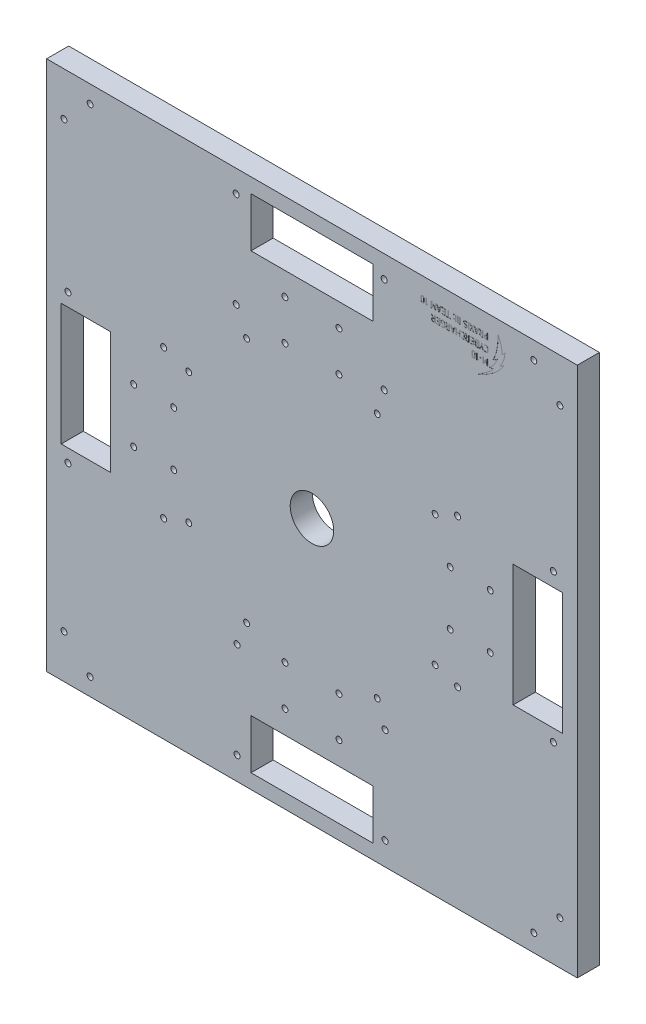
from build123d import *

# Parameters (mm, degrees)
SKETCH2_W                 = 304.8
SKETCH2_H                 = 304.8
F_1_2_MDF_DEPTH           = 12.7
SKETCH3_R                 = 12.5
CENTER_WIRING_HOLE_DEPTH  = 48
SKETCH4_W                 = 28.453201684
SKETCH4_H                 = 70
SKETCH4_W_2               = 70
SKETCH4_H_2               = 28.453201684
SKETCH4_R                 = 1.7
STEPPER_MOTOR_HOLES_DEPTH = 138
CUT_EXTRUDE2_START        = -185
SKETCH5_R                 = 1.740963855
SKETCH5_R_2               = 12.5
CUT_EXTRUDE2_DEPTH        = 185
SKETCH6_W                 = 1.235509521
SKETCH6_H                 = 0.331031597
SKETCH6_W_2               = 0.385959406
SKETCH6_H_2               = 3.5
SKETCH6_W_3               = 0.385959405
CUT_EXTRUDE3_DEPTH        = 0.05


with BuildPart() as part:
    # Sketch2 → 1/2 MDF (new body)
    with BuildSketch(Plane.XY):
        with Locations((152.4, 152.4)):
            Rectangle(SKETCH2_W, SKETCH2_H)
    extrude(amount=F_1_2_MDF_DEPTH)

    # Sketch3 → Center Wiring Hole (cut)
    with BuildSketch(Plane(origin=(0, 0, 0), x_dir=(-1, 0, 0), z_dir=(0, 0, -1))):
        with Locations((-152.4, 152.4)):
            Circle(SKETCH3_R)
    extrude(amount=-CENTER_WIRING_HOLE_DEPTH, mode=Mode.SUBTRACT)

    # Sketch4 → Stepper Motor Holes (cut)
    with BuildSketch(Plane.XY.offset(12.7)):
        Polygon((117.4, 296.416274748), (117.4, 267.963073064), (155.874164637, 267.963073064), (187.4, 267.963073064), (187.4, 296.416274748), align=None)
        with Locations((282.189673906, 152.4)):
            Rectangle(SKETCH4_W, SKETCH4_H)
        with Locations((152.4, 22.610326094)):
            Rectangle(SKETCH4_W_2, SKETCH4_H_2)
        with Locations((22.610326094, 152.4)):
            Rectangle(SKETCH4_W, SKETCH4_H)
        with Locations((136.9, 254.78040533)):
            Circle(SKETCH4_R)
        with Locations((167.9, 254.78040533)):
            Circle(SKETCH4_R)
        with Locations((136.9, 231.78116697)):
            Circle(SKETCH4_R)
        with Locations((167.9, 231.78116697)):
            Circle(SKETCH4_R)
        with Locations((25, 294.8)):
            Circle(SKETCH4_R)
        with Locations((10, 279.8)):
            Circle(SKETCH4_R)
        with Locations((114.9, 223.15)):
            Circle(SKETCH4_R)
        with Locations((189.9, 223.15)):
            Circle(SKETCH4_R)
        with Locations((189.9, 81.65)):
            Circle(SKETCH4_R)
        with Locations((114.9, 81.65)):
            Circle(SKETCH4_R)
        with Locations((294.81883303, 279.8)):
            Circle(SKETCH4_R)
        with Locations((279.81883303, 294.8)):
            Circle(SKETCH4_R)
        with Locations((254.79923836, 167.9)):
            Circle(SKETCH4_R)
        with Locations((231.8, 167.9)):
            Circle(SKETCH4_R)
        with Locations((254.79923836, 136.9)):
            Circle(SKETCH4_R)
        with Locations((231.8, 136.9)):
            Circle(SKETCH4_R)
        with Locations((279.81883303, 9.98116697)):
            Circle(SKETCH4_R)
        with Locations((294.81883303, 24.98116697)):
            Circle(SKETCH4_R)
        with Locations((167.91883303, 50.00076164)):
            Circle(SKETCH4_R)
        with Locations((167.91883303, 73)):
            Circle(SKETCH4_R)
        with Locations((136.91883303, 50.00076164)):
            Circle(SKETCH4_R)
        with Locations((136.91883303, 73)):
            Circle(SKETCH4_R)
        with Locations((10, 24.98116697)):
            Circle(SKETCH4_R)
        with Locations((25, 9.98116697)):
            Circle(SKETCH4_R)
        with Locations((50.01959467, 136.88116697)):
            Circle(SKETCH4_R)
        with Locations((73.01883303, 136.88116697)):
            Circle(SKETCH4_R)
        with Locations((50.01959467, 167.88116697)):
            Circle(SKETCH4_R)
        with Locations((73.01883303, 167.88116697)):
            Circle(SKETCH4_R)
        with Locations((81.65, 189.9)):
            Circle(SKETCH4_R)
        with Locations((81.65, 114.9)):
            Circle(SKETCH4_R)
        with Locations((223.15, 114.9)):
            Circle(SKETCH4_R)
        with Locations((223.15, 189.9)):
            Circle(SKETCH4_R)
    extrude(amount=-STEPPER_MOTOR_HOLES_DEPTH, mode=Mode.SUBTRACT)

    # Sketch5 → Cut-Extrude2 (cut)
    with BuildSketch(Plane.XY.offset(12.7).offset(CUT_EXTRUDE2_START)):
        with Locations((12.259036145, 194.9)):
            Circle(SKETCH5_R)
        with Locations((67.259036145, 194.9)):
            Circle(SKETCH5_R)
        with Locations((12.259036145, 109.9)):
            Circle(SKETCH5_R)
        with Locations((67.259036145, 109.9)):
            Circle(SKETCH5_R)
        with Locations(Location((152.4, 152.4, 0), (0, 0, 180))):
            Circle(SKETCH5_R_2)
        with Locations((193.9, 237.05)):
            Circle(SKETCH5_R)
        with Locations((193.9, 292.05)):
            Circle(SKETCH5_R)
        with Locations((108.9, 292.05)):
            Circle(SKETCH5_R)
        with Locations((108.9, 237.05)):
            Circle(SKETCH5_R)
        with Locations((236.05, 110.409036145)):
            Circle(SKETCH5_R)
        with Locations((291.05, 110.409036145)):
            Circle(SKETCH5_R)
        with Locations((291.05, 195.409036145)):
            Circle(SKETCH5_R)
        with Locations((236.05, 195.409036145)):
            Circle(SKETCH5_R)
        with Locations((109.409036145, 68.259036145)):
            Circle(SKETCH5_R)
        with Locations((109.409036145, 13.259036145)):
            Circle(SKETCH5_R)
        with Locations((194.409036145, 13.259036145)):
            Circle(SKETCH5_R)
        with Locations((194.409036145, 68.259036145)):
            Circle(SKETCH5_R)
    extrude(amount=CUT_EXTRUDE2_DEPTH, mode=Mode.SUBTRACT)

    # Sketch6 → Cut-Extrude3 (cut)
    # profile 1 of 34: a face of its own
    with BuildSketch(Plane.XY.offset(12.7)):
        with BuildLine():
            add(Edge.make_bspline(
                [(234.120113886, 294.460396438), (234.107171916, 294.448711927), (234.081198589, 294.4252622), (234.03290351, 294.402497539), (233.980015357, 294.386992971), (233.923106515, 294.383927476), (233.866431271, 294.386915439), (233.813762246, 294.402573214), (233.766034512, 294.425541113), (233.725747382, 294.459313105), (233.691975563, 294.499600063), (233.669007137, 294.547328322), (233.653351388, 294.599995326), (233.650355196, 294.656678779), (233.653451202, 294.713557186), (233.66885056, 294.766550288), (233.69198973, 294.814471782), (233.725743624, 294.85476402), (233.766035426, 294.888534471), (233.813762376, 294.911503268), (233.866429738, 294.927158912), (233.923113112, 294.930155142), (233.979991443, 294.927059096), (234.032984902, 294.91165985), (234.080905103, 294.888520289), (234.121202111, 294.854767834), (234.154954739, 294.814470653), (234.178093771, 294.766550982), (234.193495065, 294.713555471), (234.196582882, 294.656685388), (234.193616952, 294.599971639), (234.17785767, 294.547408171), (234.155261396, 294.499307777), (234.131802812, 294.473337092), (234.120113886, 294.460396438)],
                knots=[0, 0, 0, 0, 0.963155691, 1.932963746, 2.932710883, 4.006519464, 5.080328046, 6.067036254, 7.036844309, 8, 8.963155691, 9.932963746, 10.919671954, 11.993480536, 13.067289117, 14.067036254, 15.036844309, 16, 16.963155691, 17.932963746, 18.919671954, 19.993480536, 21.067289117, 22.067036254, 23.036844309, 24, 24.963155691, 25.932963746, 26.932710883, 28.006519464, 29.080328046, 30.067036254, 31.036844309, 32, 32, 32, 32], degree=3))
        make_face()
    # profile 2 of 34: a face of its own
    with BuildSketch(Plane.XY.offset(12.7)):
        with BuildLine():
            add(Edge.make_bspline(
                [(234.120113886, 292.243510061), (234.107171916, 292.231825549), (234.081198589, 292.208375822), (234.03290351, 292.185611161), (233.980015357, 292.170106593), (233.923106515, 292.167041098), (233.866431271, 292.170029061), (233.813762246, 292.185686836), (233.766034512, 292.208654735), (233.725747382, 292.242426727), (233.691975563, 292.282713685), (233.669007137, 292.330441944), (233.653351388, 292.383108948), (233.650355196, 292.439792401), (233.653451202, 292.496670808), (233.66885056, 292.549663911), (233.69198973, 292.597585404), (233.725743624, 292.637877642), (233.766035426, 292.671648093), (233.813762376, 292.69461689), (233.866429738, 292.710272534), (233.923113112, 292.713268764), (233.979991443, 292.710172719), (234.032984902, 292.694773472), (234.080905103, 292.671633911), (234.121202111, 292.637881456), (234.154954739, 292.597584275), (234.178093771, 292.549664604), (234.193495065, 292.496669093), (234.196582882, 292.439799011), (234.193616952, 292.383085261), (234.17785767, 292.330521793), (234.155261396, 292.282421399), (234.131802812, 292.256450714), (234.120113886, 292.243510061)],
                knots=[0, 0, 0, 0, 0.963155691, 1.932963746, 2.932710883, 4.006519464, 5.080328046, 6.067036254, 7.036844309, 8, 8.963155691, 9.932963746, 10.919671954, 11.993480536, 13.067289117, 14.067036254, 15.036844309, 16, 16.963155691, 17.932963746, 18.919671954, 19.993480536, 21.067289117, 22.067036254, 23.036844309, 24, 24.963155691, 25.932963746, 26.932710883, 28.006519464, 29.080328046, 30.067036254, 31.036844309, 32, 32, 32, 32], degree=3))
        make_face()
    # profile 3 of 34: a face of its own
    with BuildSketch(Plane.XY.offset(12.7)):
        with BuildLine():
            add(Edge.make_bspline(
                [(259.126273203, 297.62762517), (259.529189301, 293.074281776), (258.82690274, 288.766641181), (257.4395537, 284.70319997), (256.348084131, 283.378072168)],
                knots=[0, 0, 0, 0, 0, 1, 1, 1, 1, 1], degree=4))
            add(Edge.make_bspline(
                [(258.822462869, 284.802847016), (257.457966836, 283.57596369), (256.348084131, 283.378072168)],
                knots=[0, 0, 0, 1, 1, 1], degree=2))
            add(Edge.make_bspline(
                [(254.326936405, 278.61990753), (256.613779182, 280.092778836), (258.165025125, 282.611034095), (258.822462869, 284.802847016)],
                knots=[0, 0, 0, 0, 1, 1, 1, 1], degree=3))
            add(Edge.make_bspline(
                [(256.890190658, 279.18796581), (255.631336724, 278.505145762), (254.772057302, 278.505145762), (254.326936405, 278.61990753)],
                knots=[0, 0, 0, 0, 1, 1, 1, 1], degree=3))
            add(Edge.make_bspline(
                [(246.673709179, 271.32347256), (250.367392024, 273.356477445), (254.019145422, 275.785357498), (256.109487386, 277.975198376), (256.890190658, 279.18796581)],
                knots=[0, 0, 0, 0, 0, 1, 1, 1, 1, 1], degree=4))
            add(Edge.make_bspline(
                [(262.815583515, 283.669459981), (259.359274592, 278.095662365), (255.641404267, 275.696244062), (250.72313085, 272.746401533), (246.673709179, 271.32347256)],
                knots=[0, 0, 0, 0, 0, 1, 1, 1, 1, 1], degree=4))
            add(Edge.make_bspline(
                [(260.251669705, 282.229219973), (261.631672629, 282.454249069), (262.815583515, 283.669459981)],
                knots=[0, 0, 0, 1, 1, 1], degree=2))
            add(Edge.make_bspline(
                [(263.28975605, 290.307229225), (262.996403055, 285.957682699), (261.566032081, 283.703498548), (260.251669705, 282.229219973)],
                knots=[0, 0, 0, 0, 1, 1, 1, 1], degree=3))
            add(Edge.make_bspline(
                [(261.532681324, 288.481016908), (262.633950904, 289.169191643), (263.28975605, 290.307229225)],
                knots=[0, 0, 0, 1, 1, 1], degree=2))
            add(Edge.make_bspline(
                [(259.126273203, 297.62762517), (261.227378577, 293.5592211), (261.738875706, 289.606336673), (261.532681324, 288.481016908)],
                knots=[0, 0, 0, 0, 1, 1, 1, 1], degree=3))
        make_face()
    # profile 4 of 34: a face of its own
    with BuildSketch(Plane.XY.offset(12.7)):
        Polygon((253.454702712, 282.077889638), (253.454702712, 278.577889638), (253.068743307, 278.577889638), (252.052945022, 280.651963712), (251.037146738, 278.577889638), (250.651919703, 278.577889638), (250.651919703, 282.077889638), (251.037146738, 282.077889638), (251.037146738, 279.30440146), (251.877908404, 281.037190747), (252.228714012, 281.037190747), (253.068743307, 279.30440146), (253.068743307, 282.077889638), align=None)
    # profile 5 of 34: a face of its own
    with BuildSketch(Plane.XY.offset(12.7)):
        with Locations((249.276893548, 280.740580577)):
            Rectangle(SKETCH6_W, SKETCH6_H)
    # profile 6 of 34: a face of its own
    with BuildSketch(Plane.XY.offset(12.7)):
        Polygon((247.039134602, 282.077889638), (247.424361637, 282.077889638), (247.424361637, 279.02536819), (247.911388211, 279.277303741), (248.071777414, 278.96091956), (247.330618176, 278.577889638), (247.039134602, 278.577889638), align=None)
    # profile 7 of 34: a face of its own
    with BuildSketch(Plane.XY.offset(12.7)):
        with BuildLine():
            add(Edge.make_bspline(
                [(245.64470062, 278.610846323), (245.611486281, 278.598407469), (245.544863514, 278.573457073), (245.439622952, 278.548819132), (245.330459438, 278.534522629), (245.218458329, 278.529240053), (245.106472046, 278.53453643), (244.99702978, 278.548796887), (244.891716102, 278.573770547), (244.79170762, 278.608902388), (244.698127156, 278.652489336), (244.612980399, 278.704122256), (244.535229713, 278.761668092), (244.491132465, 278.807217481), (244.469245504, 278.829825189)],
                knots=[0, 0, 0, 0, 1.0078166, 2.021522383, 3.065237928, 4.135492849, 5.205747769, 6.249463314, 7.269922077, 8.277738677, 9.259169141, 10.199774282, 11.106486878, 12, 12, 12, 12], degree=3))
            add(Edge.make_bspline(
                [(244.469245504, 278.829825189), (244.446761061, 278.856021831), (244.403188709, 278.906788014), (244.346520169, 278.989891516), (244.301258357, 279.083269287), (244.268233178, 279.186962607), (244.241574467, 279.291542887), (244.221588338, 279.376697227), (244.210414584, 279.446284676), (244.204364929, 279.507935827), (244.198339321, 279.580426204), (244.194251917, 279.66078977), (244.192046325, 279.742859148), (244.188365796, 279.820454043), (244.187612592, 279.890548636), (244.185282538, 279.957175705), (244.186197104, 280.02872035), (244.184690567, 280.113179668), (244.185229395, 280.214739065), (244.185007787, 280.327523453), (244.185230695, 280.44055196), (244.184686034, 280.542111386), (244.18619363, 280.626570742), (244.185287998, 280.698115112), (244.187602469, 280.764986759), (244.188368153, 280.835325172), (244.192045528, 280.912920163), (244.19425242, 280.994989428), (244.198338225, 281.075353323), (244.204368089, 281.147842698), (244.210405431, 281.20949678), (244.221664698, 281.279308393), (244.241321776, 281.364544671), (244.268436784, 281.468995453), (244.301000714, 281.572396155), (244.346960736, 281.665387143), (244.402914008, 281.748927247), (244.446712642, 281.799788008), (244.469245504, 281.825954086)],
                knots=[0, 0, 0, 0, 1.19315669, 2.312205148, 3.46737585, 4.767302202, 6.067365571, 7.199894357, 7.789671257, 8.502765153, 9.341138409, 10.304733118, 11.284459737, 12.179832198, 12.990334647, 13.70800992, 14.484572927, 15.46375397, 16.628598481, 17.996024645, 19.363450809, 20.536736222, 21.507476679, 22.284039686, 23.010153553, 23.820656002, 24.716028463, 25.695755082, 26.659349791, 27.497723046, 28.210816943, 28.800593843, 29.941365465, 31.233264788, 32.53319114, 33.680781392, 34.80684331, 36, 36, 36, 36], degree=3))
            add(Edge.make_bspline(
                [(244.469245504, 281.825954086), (244.491130538, 281.848565773), (244.535223904, 281.894123177), (244.613004406, 281.951607458), (244.697943722, 282.003433363), (244.791894069, 282.046018312), (244.891801831, 282.081105847), (244.996919156, 282.107217523), (245.106485084, 282.121168741), (245.218462134, 282.126584965), (245.33043137, 282.121150051), (245.439784402, 282.107319297), (245.544598273, 282.080973203), (245.644298585, 282.046032291), (245.738244691, 282.00342982), (245.823185081, 281.95160835), (245.900965314, 281.894122961), (245.945058716, 281.848565701), (245.966943767, 281.825954086)],
                knots=[0, 0, 0, 0, 0.909446877, 1.832328609, 2.789707283, 3.785660662, 4.811449357, 5.851762917, 6.914090731, 8.00343119, 9.09277165, 10.155099464, 11.188550643, 12.214339338, 13.210292717, 14.167671391, 15.090553123, 16, 16, 16, 16], degree=3))
            add(Edge.make_bspline(
                [(245.966943767, 281.825954086), (245.98949589, 281.799797471), (246.033331964, 281.748955106), (246.089075081, 281.665191645), (246.136147131, 281.57262389), (246.168340528, 281.46894369), (246.195871586, 281.3646659), (246.21453635, 281.279243801), (246.225568784, 281.209449638), (246.233079062, 281.147938987), (246.237434834, 281.075299681), (246.242048664, 280.994999498), (246.244149402, 280.912918196), (246.247713205, 280.835324014), (246.248952978, 280.764996453), (246.249647706, 280.698103352), (246.250435662, 280.626575632), (246.251344528, 280.542110112), (246.251016224, 280.440552369), (246.25115039, 280.327523455), (246.251017577, 280.21473865), (246.251340028, 280.113180954), (246.250438582, 280.028715374), (246.249653474, 279.957187609), (246.248945728, 279.890538774), (246.247714145, 279.820455246), (246.244149044, 279.7428611), (246.24204904, 279.660779708), (246.237433789, 279.580479834), (246.233082144, 279.507839572), (246.225559826, 279.446331723), (246.214611111, 279.376762627), (246.195622754, 279.291419982), (246.168542946, 279.187014561), (246.135889331, 279.083043449), (246.089517811, 278.990084256), (246.033056893, 278.906760549), (245.989447383, 278.856012483), (245.966943767, 278.829825189)],
                knots=[0, 0, 0, 0, 1.19301362, 2.318940511, 3.470142759, 4.769913237, 6.061657649, 7.200511289, 7.790217469, 8.504174307, 9.341809483, 10.305288648, 11.284897788, 12.180162886, 12.990568148, 13.716447764, 14.492963521, 15.463587578, 16.636732302, 18.003994499, 19.371256696, 20.535961531, 21.515025161, 22.291540918, 23.008981222, 23.819386484, 24.714651581, 25.694260722, 26.657739886, 27.495375062, 28.209331901, 28.799038081, 29.929636888, 31.229544367, 32.529314846, 33.688072108, 34.80698638, 36, 36, 36, 36], degree=3))
            add(Edge.make_bspline(
                [(245.966943767, 278.829825189), (245.945060027, 278.807209471), (245.900969268, 278.761643943), (245.823168744, 278.704222052), (245.738221693, 278.652092473), (245.676312641, 278.624788359), (245.64470062, 278.610846323)],
                knots=[0, 0, 0, 0, 0.960183119, 1.934550598, 2.945339536, 4, 4, 4, 4], degree=3))
        make_face()
        with BuildLine():
            add(Edge.make_bspline(
                [(244.760729078, 279.057592505), (244.774519073, 279.043028965), (244.801963118, 279.01404546), (244.849646911, 278.977824418), (244.900097649, 278.945533178), (244.955904602, 278.920914429), (245.015500478, 278.901162308), (245.079406346, 278.886125975), (245.147721972, 278.878834372), (245.218460872, 278.875603425), (245.289199467, 278.878834595), (245.357515955, 278.886125145), (245.421418882, 278.901165207), (245.481025033, 278.920904265), (245.536795447, 278.945569476), (245.587217545, 278.977587685), (245.634266983, 279.0143016), (245.66163958, 279.0430681), (245.675460193, 279.057592505)],
                knots=[0, 0, 0, 0, 0.947058999, 1.884781565, 2.82349876, 3.774280683, 4.760101099, 5.790809835, 6.872079056, 8.004535688, 9.136992321, 10.218261541, 11.248970277, 12.234790693, 13.185572616, 14.124289812, 15.052941001, 16, 16, 16, 16], degree=3))
            add(Edge.make_bspline(
                [(245.675460193, 279.057592505), (245.69384296, 279.079865963), (245.732186069, 279.126324347), (245.77001851, 279.211171492), (245.801313208, 279.299347002), (245.821902943, 279.375863032), (245.834834995, 279.441815205), (245.842436266, 279.501766653), (245.849021503, 279.572355671), (245.853543873, 279.65079444), (245.857729038, 279.731365387), (245.861600136, 279.808246814), (245.863935803, 279.87856539), (245.864370938, 279.946447511), (245.865228752, 280.019926497), (245.866107096, 280.106833951), (245.865792411, 280.211320861), (245.865922452, 280.327523457), (245.865790822, 280.443970152), (245.866112299, 280.548457132), (245.865223367, 280.635364452), (245.864374603, 280.708599509), (245.863922118, 280.776725121), (245.861640799, 280.847045853), (245.857700324, 280.92392432), (245.853547953, 281.004252581), (245.849021552, 281.082691465), (245.842433343, 281.153279436), (245.834844144, 281.213234117), (245.821820112, 281.279405665), (245.801462482, 281.356228542), (245.769999873, 281.444602919), (245.732190251, 281.52945602), (245.693844315, 281.575913667), (245.675460193, 281.598186771)],
                knots=[0, 0, 0, 0, 1.055368237, 2.201306305, 3.380078401, 4.492718566, 5.104161551, 5.845374421, 6.709203143, 7.70562002, 8.728351822, 9.670105584, 10.530582874, 11.310061417, 12.161207078, 13.22735759, 14.499525889, 15.99566748, 17.491809072, 18.772936303, 19.830128202, 20.681273863, 21.460752406, 22.330184301, 23.262989369, 24.285721171, 25.282138048, 26.14596677, 26.88717964, 27.498622625, 28.619921599, 29.798693695, 30.944631763, 32, 32, 32, 32], degree=3))
            add(Edge.make_bspline(
                [(245.675460193, 281.598186771), (245.66163958, 281.612711175), (245.634266983, 281.641477676), (245.587217545, 281.678191591), (245.536795447, 281.7102098), (245.481025033, 281.734875011), (245.421418882, 281.754614068), (245.357515955, 281.769654131), (245.289199467, 281.776944681), (245.218460872, 281.780175851), (245.147721972, 281.776944904), (245.079406346, 281.769653301), (245.015500478, 281.754616968), (244.955904602, 281.734864847), (244.900097649, 281.710246098), (244.849646911, 281.677954858), (244.801963118, 281.641733816), (244.774519073, 281.61275031), (244.760729078, 281.598186771)],
                knots=[0, 0, 0, 0, 0.947058999, 1.875710188, 2.814427384, 3.765209307, 4.751029723, 5.781738459, 6.863007679, 7.995464312, 9.127920944, 10.209190165, 11.239898901, 12.225719317, 13.17650124, 14.115218435, 15.052941001, 16, 16, 16, 16], degree=3))
            add(Edge.make_bspline(
                [(244.760729078, 281.598186771), (244.742659578, 281.575871109), (244.704869443, 281.529200649), (244.666606283, 281.444808258), (244.636676081, 281.355925766), (244.614950696, 281.279513922), (244.602125382, 281.213222264), (244.594429655, 281.153286412), (244.588115857, 281.082659045), (244.582434197, 281.004284982), (244.578285648, 280.923942583), (244.575425228, 280.847027319), (244.57322737, 280.776718048), (244.571596361, 280.708607847), (244.570812146, 280.635364977), (244.571333331, 280.54845363), (244.569940692, 280.443972352), (244.570513797, 280.327523459), (244.569939164, 280.21131865), (244.571336821, 280.106837434), (244.570808733, 280.019926014), (244.57159915, 279.946439151), (244.573211458, 279.878572469), (244.575460438, 279.80826493), (244.578260106, 279.731347501), (244.582437413, 279.650761967), (244.588116138, 279.572388124), (244.594426578, 279.501759619), (244.602134869, 279.441827218), (244.614867311, 279.375753836), (244.636824743, 279.29965056), (244.666586728, 279.210965714), (244.70487381, 279.126579811), (244.742660991, 279.079908549), (244.760729078, 279.057592505)],
                knots=[0, 0, 0, 0, 1.050363255, 2.196705512, 3.37292669, 4.496945918, 5.108604567, 5.850078872, 6.714212279, 7.711584768, 8.734677301, 9.667423966, 10.537162521, 11.31707049, 12.168516361, 13.226043172, 14.507653609, 16.00432291, 17.50099221, 18.773640776, 19.840129679, 20.69157555, 21.471483519, 22.33226431, 23.273966508, 24.297059041, 25.29443153, 26.158564937, 26.900039242, 27.511697891, 28.62707331, 29.803294488, 30.949636745, 32, 32, 32, 32], degree=3))
        make_face(mode=Mode.SUBTRACT)
    # profile 8 of 34: a face of its own
    with BuildSketch(Plane.XY.offset(12.7)):
        with BuildLine():
            add(Edge.make_bspline(
                [(252.372258686, 284.936855949), (252.330948685, 284.937535068), (252.248794286, 284.938885651), (252.127287121, 284.954791805), (252.007521528, 284.976728241), (251.890711163, 285.010288927), (251.775483881, 285.051698596), (251.66384844, 285.104656798), (251.552807011, 285.164039184), (251.482763225, 285.211577271), (251.44727438, 285.235663231)],
                knots=[0, 0, 0, 0, 1.003053514, 1.994801625, 2.973138068, 3.958997531, 4.944142991, 5.944615135, 6.958605191, 8, 8, 8, 8], degree=3))
            Line((251.44727438, 285.235663231), (251.645014493, 285.5322734))
            add(Edge.make_bspline(
                [(251.645014493, 285.5322734), (251.674288941, 285.512328236), (251.731674549, 285.473230475), (251.82110369, 285.422459102), (251.910859405, 285.379271364), (252.001556344, 285.343549319), (252.093329467, 285.31667244), (252.185552538, 285.296735519), (252.278670393, 285.284457187), (252.340974195, 285.283177519), (252.372258686, 285.282534961)],
                knots=[0, 0, 0, 0, 1.087441723, 2.131671454, 3.154366119, 4.144192146, 5.121475746, 6.087509373, 7.039684671, 8, 8, 8, 8], degree=3))
            add(Edge.make_bspline(
                [(252.372258686, 285.282534961), (252.413356115, 285.283714471), (252.492886675, 285.285997025), (252.606958484, 285.305906722), (252.711002305, 285.338682962), (252.804207841, 285.385415408), (252.888002744, 285.444248266), (252.959065843, 285.518541744), (253.022369805, 285.604004239), (253.052994931, 285.669325569), (253.068743307, 285.702915794)],
                knots=[0, 0, 0, 0, 1.136215415, 2.198771323, 3.191903734, 4.143285117, 5.072818389, 6.00885488, 6.976092325, 8, 8, 8, 8], degree=3))
            add(Edge.make_bspline(
                [(253.068743307, 285.702915794), (253.081248357, 285.734214634), (253.106948035, 285.79853825), (253.135971059, 285.901510251), (253.156879875, 286.012843456), (253.170960813, 286.133296705), (253.181167473, 286.264748663), (253.187104368, 286.40888071), (253.191750499, 286.566593717), (253.192912981, 286.733361563), (253.191745936, 286.900129007), (253.187127493, 287.05759932), (253.181136709, 287.201484354), (253.170973404, 287.332695331), (253.156816371, 287.453380973), (253.13595201, 287.565197165), (253.107080517, 287.668712453), (253.081263159, 287.733245131), (253.068743307, 287.764539565)],
                knots=[0, 0, 0, 0, 0.773666313, 1.589995524, 2.452059532, 3.372784305, 4.373836133, 5.479482845, 6.685365129, 7.997350905, 9.30933668, 10.515218965, 11.615264976, 12.616316804, 13.537041577, 14.404612179, 15.226333687, 16, 16, 16, 16], degree=3))
            add(Edge.make_bspline(
                [(253.068743307, 287.764539565), (253.052990843, 287.798123677), (253.022357768, 287.863433121), (252.959110295, 287.948980085), (252.887743049, 288.023069993), (252.804656571, 288.083033336), (252.710753359, 288.128535467), (252.607000925, 288.1616275), (252.492874883, 288.181436423), (252.413352098, 288.183733423), (252.372258686, 288.184920397)],
                knots=[0, 0, 0, 0, 1.02378731, 1.990911051, 2.926837506, 3.860202615, 4.80847149, 5.801487153, 6.863918153, 8, 8, 8, 8], degree=3))
            add(Edge.make_bspline(
                [(252.372258686, 288.184920397), (252.334865973, 288.184146809), (252.261033691, 288.182619351), (252.151904959, 288.168318647), (252.046527953, 288.14451559), (251.943812307, 288.113629631), (251.845476856, 288.070985484), (251.74984906, 288.020631095), (251.657863076, 287.960226834), (251.600220899, 287.913937103), (251.571045043, 287.89050734)],
                knots=[0, 0, 0, 0, 1.028620319, 2.031020948, 3.021988481, 3.999429161, 4.977677499, 5.966388194, 6.97067794, 8, 8, 8, 8], degree=3))
            Line((251.571045043, 287.89050734), (251.353530919, 288.176864319))
            add(Edge.make_bspline(
                [(251.353530919, 288.176864319), (251.391160682, 288.205107496), (251.46561032, 288.260985985), (251.584235091, 288.332600363), (251.70627512, 288.39399948), (251.832371377, 288.443623695), (251.962139531, 288.482850304), (252.095424185, 288.510646021), (252.23270276, 288.526959818), (252.325343726, 288.529375877), (252.372258686, 288.53059941)],
                knots=[0, 0, 0, 0, 1.026760027, 2.031421569, 3.020693825, 4.006556845, 4.986305546, 5.977342528, 6.97569185, 8, 8, 8, 8], degree=3))
            add(Edge.make_bspline(
                [(252.372258686, 288.53059941), (252.403523614, 288.529996999), (252.465180545, 288.528808997), (252.555925663, 288.520610358), (252.643248943, 288.50748816), (252.727087325, 288.489439518), (252.807037493, 288.465061352), (252.883430885, 288.435765825), (252.95655177, 288.401257928), (253.02575983, 288.360802513), (253.091586206, 288.316569549), (253.152564814, 288.267560136), (253.210171236, 288.216023547), (253.261990019, 288.158916685), (253.310536496, 288.099013681), (253.354604859, 288.035257285), (253.39372359, 287.967244255), (253.416208517, 287.919721051), (253.427604993, 287.895633936)],
                knots=[0, 0, 0, 0, 1.14757066, 2.263100851, 3.341592438, 4.387424637, 5.407958689, 6.406459366, 7.388499, 8.372172645, 9.346454514, 10.296703122, 11.241867884, 12.180425258, 13.123676514, 14.070708522, 15.022139451, 16, 16, 16, 16], degree=3))
            add(Edge.make_bspline(
                [(253.427604993, 287.895633936), (253.438478203, 287.869655731), (253.461040303, 287.815750503), (253.488653845, 287.728804098), (253.511611394, 287.633736927), (253.530841163, 287.532949917), (253.546213207, 287.431482219), (253.559247629, 287.333879564), (253.566931552, 287.242198228), (253.572401551, 287.153799514), (253.574958828, 287.062693694), (253.577473277, 286.963339793), (253.577656861, 286.852248048), (253.578191704, 286.77437364), (253.578473376, 286.733361494)],
                knots=[0, 0, 0, 0, 0.858801395, 1.782027876, 2.779078121, 3.840914462, 4.911049472, 5.909600504, 6.844112112, 7.71700576, 8.611179608, 9.624260494, 10.748829338, 12, 12, 12, 12], degree=3))
            add(Edge.make_bspline(
                [(253.578473376, 286.733361494), (253.578363539, 286.669882928), (253.57815226, 286.547777954), (253.571788216, 286.371741285), (253.563442529, 286.210296933), (253.551480829, 286.062381185), (253.533516235, 285.926000795), (253.50756727, 285.799261818), (253.472648785, 285.68137078), (253.442369252, 285.607729037), (253.427604993, 285.571821423)],
                knots=[0, 0, 0, 0, 1.291491746, 2.484264805, 3.583617371, 4.580625462, 5.502974639, 6.380695988, 7.210429575, 8, 8, 8, 8], degree=3))
            add(Edge.make_bspline(
                [(253.427604993, 285.571821423), (253.416018118, 285.547457968), (253.39309783, 285.499264009), (253.352486223, 285.431040793), (253.307604597, 285.366962787), (253.258377797, 285.30698999), (253.205520871, 285.250237128), (253.1483949, 285.197408116), (253.086667315, 285.148930646), (253.020645822, 285.105131397), (252.951237705, 285.065532454), (252.87848011, 285.031175004), (252.802608801, 285.001226557), (252.72265519, 284.978596429), (252.63995705, 284.95903425), (252.55375505, 284.94594833), (252.464170025, 284.938857047), (252.403274462, 284.937531226), (252.372258686, 284.936855949)],
                knots=[0, 0, 0, 0, 0.990708674, 1.95974554, 2.912711584, 3.862422361, 4.807888788, 5.759925892, 6.718026987, 7.688142358, 8.668198161, 9.651081467, 10.642074273, 11.66092242, 12.700868586, 13.762554404, 14.860407769, 16, 16, 16, 16], degree=3))
        make_face()
    # profile 9 of 34: a face of its own
    with BuildSketch(Plane.XY.offset(12.7)):
        Polygon((251.128693087, 284.983727679), (250.711241737, 284.983727679), (249.890986454, 286.82271073), (249.069998799, 284.983727679), (248.65254745, 284.983727679), (249.697640565, 287.232838372), (249.697640565, 288.483727679), (250.083599971, 288.483727679), (250.083599971, 287.232838372), align=None)
    # profile 10 of 34: a face of its own
    with BuildSketch(Plane.XY.offset(12.7)):
        with BuildLine():
            add(Edge.make_bspline(
                [(246.558699364, 286.666715752), (246.521374296, 286.687873089), (246.447899487, 286.729521542), (246.350827193, 286.8097641), (246.264683606, 286.899237055), (246.192782411, 287.000975796), (246.134818254, 287.113159607), (246.094407584, 287.235523626), (246.068322355, 287.366983277), (246.065699579, 287.457790358), (246.064349082, 287.504547935)],
                knots=[0, 0, 0, 0, 1.002145327, 1.972734178, 2.93432269, 3.901122368, 4.876991345, 5.877686824, 6.90719732, 8, 8, 8, 8], degree=3))
            add(Edge.make_bspline(
                [(246.064349082, 287.504547935), (246.064965653, 287.530931621), (246.066184536, 287.583088819), (246.074289397, 287.660494829), (246.088333036, 287.735826704), (246.107340672, 287.809597983), (246.132177229, 287.881428396), (246.163346698, 287.951201961), (246.199192151, 288.019275787), (246.2398498, 288.085390003), (246.286885012, 288.147260206), (246.337833983, 288.205261916), (246.393768364, 288.257835788), (246.455255828, 288.303725842), (246.520189688, 288.34589592), (246.590512433, 288.381760662), (246.665201725, 288.412726119), (246.717475946, 288.428735878), (246.743989174, 288.436855949)],
                knots=[0, 0, 0, 0, 1.01896124, 2.014356944, 3.001862519, 3.976045471, 4.954053406, 5.933378402, 6.924478186, 7.923884544, 8.927064019, 9.922236435, 10.902831397, 11.885282991, 12.881749781, 13.889570663, 14.929600606, 16, 16, 16, 16], degree=3))
            add(Edge.make_bspline(
                [(246.743989174, 288.436855949), (246.75859466, 288.440702664), (246.789781643, 288.448916524), (246.840010597, 288.457907703), (246.8961746, 288.466098543), (246.958004485, 288.472445418), (247.025649667, 288.477573661), (247.098913394, 288.481133941), (247.178027123, 288.48334704), (247.232723039, 288.483597828), (247.261042951, 288.483727679)],
                knots=[0, 0, 0, 0, 0.69611345, 1.486405777, 2.350736339, 3.312800728, 4.351298627, 5.478253423, 6.694314949, 8, 8, 8, 8], degree=3))
            Line((247.261042951, 288.483727679), (248.205068898, 288.483727679))
            Line((248.205068898, 288.483727679), (248.205068898, 284.983727679))
            Line((248.205068898, 284.983727679), (247.335012401, 284.983727679))
            add(Edge.make_bspline(
                [(247.335012401, 284.983727679), (247.308403823, 284.983954022), (247.257135796, 284.984390128), (247.182875019, 284.985308476), (247.114292681, 284.989362233), (247.051300039, 284.993669223), (246.994099707, 284.998521657), (246.942788832, 285.005085992), (246.897015616, 285.012896401), (246.868701863, 285.019942782), (246.855309534, 285.023275702)],
                knots=[0, 0, 0, 0, 1.323795523, 2.550620582, 3.693808175, 4.740765511, 5.691835804, 6.548941546, 7.313653237, 8, 8, 8, 8], degree=3))
            add(Edge.make_bspline(
                [(246.855309534, 285.023275702), (246.830778321, 285.030478508), (246.782576988, 285.044631289), (246.712848474, 285.072002667), (246.646889554, 285.105200847), (246.58411615, 285.143036616), (246.524703771, 285.186012619), (246.469172803, 285.234387775), (246.416980389, 285.28802758), (246.36901991, 285.34652717), (246.324804587, 285.408551), (246.2868221, 285.474286492), (246.255312354, 285.543143945), (246.228686054, 285.614256659), (246.208202206, 285.688528461), (246.193640128, 285.765682557), (246.184610039, 285.845757169), (246.18353759, 285.90014374), (246.18299315, 285.927753626)],
                knots=[0, 0, 0, 0, 1.00899201, 1.982566404, 2.952317221, 3.920870075, 4.873176082, 5.843262064, 6.824675538, 7.82418759, 8.826900464, 9.828640257, 10.816092095, 11.813231719, 12.82332776, 13.853454694, 14.910284811, 16, 16, 16, 16], degree=3))
            add(Edge.make_bspline(
                [(246.18299315, 285.927753626), (246.18401042, 285.966887071), (246.185999593, 286.043408753), (246.204736419, 286.154858986), (246.235611103, 286.259564184), (246.278109168, 286.357676594), (246.332695336, 286.448005587), (246.397460413, 286.530521785), (246.472494111, 286.604869846), (246.529781585, 286.64596938), (246.558699364, 286.666715752)],
                knots=[0, 0, 0, 0, 1.085311573, 2.122222211, 3.125432025, 4.108422378, 5.080897657, 6.045863363, 7.013583811, 8, 8, 8, 8], degree=3))
        make_face()
        with BuildLine():
            Line((247.819109492, 286.526100561), (247.335012401, 286.526100561))
            add(Edge.make_bspline(
                [(247.335012401, 286.526100561), (247.316215086, 286.526072589), (247.281061666, 286.52602028), (247.232232347, 286.526355251), (247.19097772, 286.525373461), (247.145055392, 286.524603597), (247.089384924, 286.521791682), (247.022421539, 286.511998456), (246.955863625, 286.499240104), (246.914473955, 286.483675909), (246.894857556, 286.476299347)],
                knots=[0, 0, 0, 0, 1.011694303, 1.891999735, 2.627894712, 3.232426313, 4.36427871, 5.624105469, 6.873958286, 8, 8, 8, 8], degree=3))
            add(Edge.make_bspline(
                [(246.894857556, 286.476299347), (246.868202925, 286.463288161), (246.815998297, 286.437805004), (246.747955209, 286.384800922), (246.691087194, 286.322015923), (246.646139575, 286.250227588), (246.612571758, 286.17273322), (246.58701111, 286.09310902), (246.572066248, 286.011070508), (246.569994794, 285.955642091), (246.568952555, 285.927753626)],
                knots=[0, 0, 0, 0, 1.050941148, 2.058328676, 3.040294675, 4.045554035, 5.050701261, 6.032208004, 7.009917654, 8, 8, 8, 8], degree=3))
            add(Edge.make_bspline(
                [(246.568952555, 285.927753626), (246.569711891, 285.905258986), (246.571263868, 285.859283071), (246.582630073, 285.788703354), (246.603512275, 285.714419038), (246.63116164, 285.634775995), (246.676020997, 285.554428663), (246.73922648, 285.479802705), (246.819397998, 285.415303533), (246.882641019, 285.386469479), (246.914631568, 285.371884197)],
                knots=[0, 0, 0, 0, 0.775773634, 1.58557334, 2.457713673, 3.435328552, 4.487040688, 5.610394982, 6.79125356, 8, 8, 8, 8], degree=3))
            add(Edge.make_bspline(
                [(246.914631568, 285.371884197), (246.924814797, 285.368218665), (246.946773842, 285.360314337), (246.984085097, 285.353079085), (247.026983178, 285.345466701), (247.076433277, 285.34010578), (247.132038353, 285.334467571), (247.194147132, 285.332303372), (247.262486173, 285.329680562), (247.310108085, 285.329500734), (247.335012401, 285.329406692)],
                knots=[0, 0, 0, 0, 0.611433152, 1.318490202, 2.144952615, 3.076853602, 4.130922288, 5.30614512, 6.591223856, 8, 8, 8, 8], degree=3))
            Line((247.335012401, 285.329406692), (247.819109492, 285.329406692))
            Line((247.819109492, 285.329406692), (247.819109492, 286.526100561))
        make_face(mode=Mode.SUBTRACT)
        with BuildLine():
            Line((247.819109492, 286.871779573), (247.819109492, 288.137316296))
            Line((247.819109492, 288.137316296), (247.261042951, 288.137316296))
            add(Edge.make_bspline(
                [(247.261042951, 288.137316296), (247.241268422, 288.137394087), (247.204647154, 288.137538151), (247.153627575, 288.13662364), (247.110662476, 288.135872553), (247.062521148, 288.135188208), (247.003227148, 288.131203777), (246.930598706, 288.121089162), (246.856760386, 288.107071985), (246.810688279, 288.089380873), (246.788663792, 288.080923745)],
                knots=[0, 0, 0, 0, 0.990901854, 1.835092075, 2.556963757, 3.144292273, 4.247738291, 5.531483167, 6.819940758, 8, 8, 8, 8], degree=3))
            add(Edge.make_bspline(
                [(246.788663792, 288.080923745), (246.760279999, 288.066456616), (246.705042707, 288.038302344), (246.632844215, 287.981477779), (246.57305455, 287.914680338), (246.527601408, 287.838178989), (246.493864153, 287.756804651), (246.468565404, 287.673958069), (246.453437128, 287.589564797), (246.451352775, 287.532925138), (246.450308488, 287.504547935)],
                knots=[0, 0, 0, 0, 1.078691369, 2.099225819, 3.096476343, 4.103479741, 5.10176137, 6.079038811, 7.037573515, 8, 8, 8, 8], degree=3))
            add(Edge.make_bspline(
                [(246.450308488, 287.504547935), (246.451107438, 287.477393654), (246.452708695, 287.422971062), (246.4672819, 287.341596214), (246.491475998, 287.26038041), (246.523191873, 287.177826693), (246.571352515, 287.097686297), (246.636551339, 287.024615127), (246.718124326, 286.962132228), (246.781393433, 286.933793369), (246.813564399, 286.919383674)],
                knots=[0, 0, 0, 0, 0.888249358, 1.780228763, 2.695629989, 3.660110043, 4.667335426, 5.737029276, 6.849328536, 8, 8, 8, 8], degree=3))
            add(Edge.make_bspline(
                [(246.813564399, 286.919383674), (246.833926396, 286.912260288), (246.876872651, 286.897236086), (246.945313734, 286.8851506), (247.013284963, 286.876345876), (247.069129468, 286.873353134), (247.114807835, 286.872270163), (247.156318026, 286.872793636), (247.205866756, 286.871454157), (247.241756324, 286.871665825), (247.261042951, 286.871779573)],
                knots=[0, 0, 0, 0, 1.142171302, 2.408996459, 3.674233287, 4.776460016, 5.372070543, 6.096990344, 6.977345281, 8, 8, 8, 8], degree=3))
            Line((247.261042951, 286.871779573), (247.819109492, 286.871779573))
        make_face(mode=Mode.SUBTRACT)
    # profile 11 of 34: a face of its own
    with BuildSketch(Plane.XY.offset(12.7)):
        Polygon((245.439636799, 284.983727679), (243.511304512, 284.983727679), (243.511304512, 285.329406692), (245.053677393, 285.329406692), (245.053677393, 286.526100561), (243.733945232, 286.526100561), (243.733945232, 286.871779573), (245.053677393, 286.871779573), (245.053677393, 288.137316296), (243.511304512, 288.137316296), (243.511304512, 288.483727679), (245.439636799, 288.483727679), align=None)
    # profile 12 of 34: a face of its own
    with BuildSketch(Plane.XY.offset(12.7)):
        with BuildLine():
            add(Edge.make_bspline(
                [(242.006282541, 284.983727679), (241.979673411, 284.983680819), (241.93011566, 284.983593544), (241.861261266, 284.98414975), (241.803418844, 284.98592047), (241.738343224, 284.987253972), (241.65737359, 284.995516297), (241.554759512, 285.009602728), (241.445801025, 285.034786911), (241.374715039, 285.061758265), (241.339092752, 285.075274028)],
                knots=[0, 0, 0, 0, 0.94144645, 1.753381989, 2.435933364, 2.988979105, 4.055585163, 5.312486946, 6.653245612, 8, 8, 8, 8], degree=3))
            add(Edge.make_bspline(
                [(241.339092752, 285.075274028), (241.316222166, 285.085175073), (241.270885402, 285.104802089), (241.205993125, 285.140382928), (241.14489771, 285.180455708), (241.086977508, 285.224857677), (241.032688332, 285.274164339), (240.981720721, 285.327994229), (240.934381304, 285.386626387), (240.890712143, 285.44920448), (240.851382437, 285.515225211), (240.817587375, 285.584221001), (240.787828441, 285.655119692), (240.764880015, 285.729088519), (240.746290696, 285.805118387), (240.733028126, 285.883415737), (240.725940465, 285.964241417), (240.7245863, 286.018799336), (240.723901289, 286.046397694)],
                knots=[0, 0, 0, 0, 0.978971625, 1.94063258, 2.9038714, 3.847953059, 4.805633949, 5.782864761, 6.758257297, 7.764260899, 8.779417421, 9.774798055, 10.781396154, 11.797821169, 12.814653578, 13.855593685, 14.915242813, 16, 16, 16, 16], degree=3))
            add(Edge.make_bspline(
                [(240.723901289, 286.046397694), (240.724510076, 286.074246096), (240.725714166, 286.129326111), (240.73388798, 286.210577243), (240.747274373, 286.28955073), (240.764972261, 286.366177368), (240.789893846, 286.44006802), (240.818783193, 286.511728743), (240.853622347, 286.580843156), (240.89276689, 286.647512333), (240.937577789, 286.709899149), (240.985153686, 286.768929201), (241.036403511, 286.823232494), (241.091475891, 286.872552809), (241.150380211, 286.916387558), (241.212194269, 286.956174999), (241.277327437, 286.991780613), (241.323278965, 287.010849357), (241.34641646, 287.020450843)],
                knots=[0, 0, 0, 0, 1.08729253, 2.150503566, 3.184735514, 4.213550638, 5.217289106, 6.226218854, 7.227963978, 8.236578499, 9.241583401, 10.224097625, 11.195030841, 12.15362737, 13.106806176, 14.058649596, 15.022492014, 16, 16, 16, 16], degree=3))
            Line((241.34641646, 287.020450843), (240.661649772, 288.483727679))
            Line((240.661649772, 288.483727679), (241.079833493, 288.483727679))
            Line((241.079833493, 288.483727679), (241.707475259, 287.109067709))
            Line((241.707475259, 287.109067709), (242.428860486, 287.109067709))
            Line((242.428860486, 287.109067709), (242.428860486, 288.483727679))
            Line((242.428860486, 288.483727679), (242.814819892, 288.483727679))
            Line((242.814819892, 288.483727679), (242.814819892, 284.983727679))
            Line((242.814819892, 284.983727679), (242.006282541, 284.983727679))
        make_face()
        with BuildLine():
            Line((242.006282541, 285.329406692), (242.428860486, 285.329406692))
            Line((242.428860486, 285.329406692), (242.428860486, 286.763388696))
            Line((242.428860486, 286.763388696), (242.006282541, 286.763388696))
            add(Edge.make_bspline(
                [(242.006282541, 286.763388696), (241.985043011, 286.763477515), (241.945736026, 286.763641888), (241.891057856, 286.762600864), (241.845145872, 286.762228324), (241.79384864, 286.760116138), (241.730882318, 286.755899765), (241.653621611, 286.744903173), (241.57530184, 286.73014642), (241.525922796, 286.712478888), (241.502411438, 286.704066662)],
                knots=[0, 0, 0, 0, 0.998783577, 1.848401198, 2.571749379, 3.157693234, 4.262725227, 5.537242143, 6.827381494, 8, 8, 8, 8], degree=3))
            add(Edge.make_bspline(
                [(241.502411438, 286.704066662), (241.484447363, 286.695813053), (241.448977308, 286.679516305), (241.398561923, 286.650134068), (241.352647061, 286.615415364), (241.296902985, 286.565751327), (241.238392941, 286.496221775), (241.186550296, 286.405131949), (241.151802305, 286.312417655), (241.125929034, 286.222587775), (241.112001969, 286.13402707), (241.107681429, 286.0466384), (241.112098805, 285.959027795), (241.125819905, 285.87042898), (241.1518482, 285.780400734), (241.186325061, 285.687773809), (241.238855398, 285.597126035), (241.2967724, 285.527231032), (241.352397061, 285.477266538), (241.399024585, 285.443605915), (241.448721866, 285.413102938), (241.484399759, 285.396905741), (241.502411438, 285.388728726)],
                knots=[0, 0, 0, 0, 0.729554118, 1.440504165, 2.148822114, 2.850805899, 4.193874288, 5.481531484, 6.699838516, 7.841156017, 8.927125225, 10.000873764, 11.065622184, 12.160491248, 13.301808749, 14.520115781, 15.799960392, 17.149934372, 17.851918158, 18.554884588, 19.270445882, 20, 20, 20, 20], degree=3))
            add(Edge.make_bspline(
                [(241.502411438, 285.388728726), (241.525940983, 285.380417116), (241.575406351, 285.3629439), (241.653440563, 285.346493172), (241.73100793, 285.33771456), (241.793791959, 285.331269133), (241.845165877, 285.33091474), (241.891053433, 285.330074605), (241.945737447, 285.329192039), (241.98504351, 285.329331392), (242.006282541, 285.329406692)],
                knots=[0, 0, 0, 0, 1.172405303, 2.464708104, 3.737493248, 4.843218324, 5.428718212, 6.151934875, 7.001398019, 8, 8, 8, 8], degree=3))
        make_face(mode=Mode.SUBTRACT)
    # profile 13 of 34: a face of its own
    with BuildSketch(Plane.XY.offset(12.7)):
        with BuildLine():
            add(Edge.make_bspline(
                [(239.013815497, 284.936855949), (238.972505496, 284.937535068), (238.890351097, 284.938885651), (238.768843932, 284.954791805), (238.649078339, 284.976728241), (238.532267974, 285.010288927), (238.417040692, 285.051698596), (238.305405251, 285.104656798), (238.194363822, 285.164039184), (238.124320036, 285.211577271), (238.088831191, 285.235663231)],
                knots=[0, 0, 0, 0, 1.003053514, 1.994801625, 2.973138068, 3.958997531, 4.944142991, 5.944615135, 6.958605191, 8, 8, 8, 8], degree=3))
            Line((238.088831191, 285.235663231), (238.286571304, 285.5322734))
            add(Edge.make_bspline(
                [(238.286571304, 285.5322734), (238.315845752, 285.512328236), (238.37323136, 285.473230475), (238.462660501, 285.422459102), (238.552416216, 285.379271364), (238.643113155, 285.343549319), (238.734886278, 285.31667244), (238.827109349, 285.296735519), (238.920227204, 285.284457187), (238.982531006, 285.283177519), (239.013815497, 285.282534961)],
                knots=[0, 0, 0, 0, 1.087441723, 2.131671454, 3.154366119, 4.144192146, 5.121475746, 6.087509373, 7.039684671, 8, 8, 8, 8], degree=3))
            add(Edge.make_bspline(
                [(239.013815497, 285.282534961), (239.054912926, 285.283714471), (239.134443486, 285.285997025), (239.248515295, 285.305906722), (239.352559116, 285.338682962), (239.445764652, 285.385415408), (239.529559555, 285.444248266), (239.600622654, 285.518541744), (239.663926616, 285.604004239), (239.694551742, 285.669325569), (239.710300118, 285.702915794)],
                knots=[0, 0, 0, 0, 1.136215415, 2.198771323, 3.191903734, 4.143285117, 5.072818389, 6.00885488, 6.976092325, 8, 8, 8, 8], degree=3))
            add(Edge.make_bspline(
                [(239.710300118, 285.702915794), (239.722805168, 285.734214634), (239.748504846, 285.79853825), (239.77752787, 285.901510251), (239.798436686, 286.012843456), (239.812517624, 286.133296705), (239.822724284, 286.264748663), (239.828661179, 286.40888071), (239.83330731, 286.566593717), (239.834469792, 286.733361563), (239.833302747, 286.900129007), (239.828684304, 287.05759932), (239.82269352, 287.201484354), (239.812530215, 287.332695331), (239.798373182, 287.453380973), (239.777508821, 287.565197165), (239.748637328, 287.668712453), (239.72281997, 287.733245131), (239.710300118, 287.764539565)],
                knots=[0, 0, 0, 0, 0.773666313, 1.589995524, 2.452059532, 3.372784305, 4.373836133, 5.479482845, 6.685365129, 7.997350905, 9.30933668, 10.515218965, 11.615264976, 12.616316804, 13.537041577, 14.404612179, 15.226333687, 16, 16, 16, 16], degree=3))
            add(Edge.make_bspline(
                [(239.710300118, 287.764539565), (239.694547654, 287.798123677), (239.663914579, 287.863433121), (239.600667106, 287.948980085), (239.52929986, 288.023069993), (239.446213382, 288.083033336), (239.35231017, 288.128535467), (239.248557737, 288.1616275), (239.134431694, 288.181436423), (239.054908909, 288.183733423), (239.013815497, 288.184920397)],
                knots=[0, 0, 0, 0, 1.02378731, 1.990911051, 2.926837506, 3.860202615, 4.80847149, 5.801487153, 6.863918153, 8, 8, 8, 8], degree=3))
            add(Edge.make_bspline(
                [(239.013815497, 288.184920397), (238.976422784, 288.184146809), (238.902590502, 288.182619351), (238.793461771, 288.168318647), (238.688084764, 288.14451559), (238.585369118, 288.113629631), (238.487033667, 288.070985484), (238.391405871, 288.020631095), (238.299419887, 287.960226834), (238.24177771, 287.913937103), (238.212601854, 287.89050734)],
                knots=[0, 0, 0, 0, 1.028620319, 2.031020948, 3.021988481, 3.999429161, 4.977677499, 5.966388194, 6.97067794, 8, 8, 8, 8], degree=3))
            Line((238.212601854, 287.89050734), (237.99508773, 288.176864319))
            add(Edge.make_bspline(
                [(237.99508773, 288.176864319), (238.032717493, 288.205107496), (238.107167131, 288.260985985), (238.225791902, 288.332600363), (238.347831931, 288.39399948), (238.473928188, 288.443623695), (238.603696342, 288.482850304), (238.736980996, 288.510646021), (238.874259571, 288.526959818), (238.966900537, 288.529375877), (239.013815497, 288.53059941)],
                knots=[0, 0, 0, 0, 1.026760027, 2.031421569, 3.020693825, 4.006556845, 4.986305546, 5.977342528, 6.97569185, 8, 8, 8, 8], degree=3))
            add(Edge.make_bspline(
                [(239.013815497, 288.53059941), (239.045080425, 288.529996999), (239.106737356, 288.528808997), (239.197482474, 288.520610358), (239.284805754, 288.50748816), (239.368644136, 288.489439518), (239.448594304, 288.465061352), (239.524987696, 288.435765825), (239.598108581, 288.401257928), (239.667316641, 288.360802513), (239.733143017, 288.316569549), (239.794121625, 288.267560136), (239.851728047, 288.216023547), (239.90354683, 288.158916685), (239.952093307, 288.099013681), (239.99616167, 288.035257285), (240.035280401, 287.967244255), (240.057765329, 287.919721051), (240.069161804, 287.895633936)],
                knots=[0, 0, 0, 0, 1.14757066, 2.263100851, 3.341592438, 4.387424637, 5.407958689, 6.406459366, 7.388499, 8.372172645, 9.346454514, 10.296703122, 11.241867884, 12.180425258, 13.123676514, 14.070708522, 15.022139451, 16, 16, 16, 16], degree=3))
            add(Edge.make_bspline(
                [(240.069161804, 287.895633936), (240.080035014, 287.869655731), (240.102597114, 287.815750503), (240.130210656, 287.728804098), (240.153168205, 287.633736927), (240.172397974, 287.532949917), (240.187770018, 287.431482219), (240.20080444, 287.333879564), (240.208488363, 287.242198228), (240.213958362, 287.153799514), (240.216515639, 287.062693694), (240.219030088, 286.963339793), (240.219213673, 286.852248048), (240.219748515, 286.77437364), (240.220030187, 286.733361494)],
                knots=[0, 0, 0, 0, 0.858801395, 1.782027876, 2.779078121, 3.840914462, 4.911049472, 5.909600504, 6.844112112, 7.71700576, 8.611179608, 9.624260494, 10.748829338, 12, 12, 12, 12], degree=3))
            add(Edge.make_bspline(
                [(240.220030187, 286.733361494), (240.21992035, 286.669882928), (240.219709071, 286.547777954), (240.213345027, 286.371741285), (240.20499934, 286.210296933), (240.19303764, 286.062381185), (240.175073046, 285.926000795), (240.149124082, 285.799261818), (240.114205596, 285.68137078), (240.083926063, 285.607729037), (240.069161804, 285.571821423)],
                knots=[0, 0, 0, 0, 1.291491746, 2.484264805, 3.583617371, 4.580625462, 5.502974639, 6.380695988, 7.210429575, 8, 8, 8, 8], degree=3))
            add(Edge.make_bspline(
                [(240.069161804, 285.571821423), (240.057574929, 285.547457968), (240.034654641, 285.499264009), (239.994043034, 285.431040793), (239.949161408, 285.366962787), (239.899934608, 285.30698999), (239.847077682, 285.250237128), (239.789951711, 285.197408116), (239.728224126, 285.148930646), (239.662202633, 285.105131397), (239.592794516, 285.065532454), (239.520036921, 285.031175004), (239.444165612, 285.001226557), (239.364212001, 284.978596429), (239.281513861, 284.95903425), (239.195311861, 284.94594833), (239.105726836, 284.938857047), (239.044831273, 284.937531226), (239.013815497, 284.936855949)],
                knots=[0, 0, 0, 0, 0.990708674, 1.95974554, 2.912711584, 3.862422361, 4.807888788, 5.759925892, 6.718026987, 7.688142358, 8.668198161, 9.651081467, 10.642074273, 11.66092242, 12.700868586, 13.762554404, 14.860407769, 16, 16, 16, 16], degree=3))
        make_face()
    # profile 14 of 34: a face of its own
    with BuildSketch(Plane.XY.offset(12.7)):
        Polygon((237.424570886, 284.983727679), (237.03861148, 284.983727679), (237.03861148, 286.526100561), (235.535786621, 286.526100561), (235.535786621, 284.983727679), (235.150559586, 284.983727679), (235.150559586, 288.483727679), (235.535786621, 288.483727679), (235.535786621, 286.871779573), (237.03861148, 286.871779573), (237.03861148, 288.483727679), (237.424570886, 288.483727679), align=None)
    # profile 15 of 34: a face of its own
    with BuildSketch(Plane.XY.offset(12.7)):
        Polygon((233.537146738, 284.983727679), (233.166567119, 284.983727679), (231.980126441, 288.483727679), (232.382930375, 288.483727679), (232.657569421, 287.638571789), (234.046876807, 287.638571789), (234.320783482, 288.483727679), (234.723587416, 288.483727679), align=None)
        Polygon((232.771086893, 287.292160406), (233.351856929, 285.505175681), (233.932626964, 287.292160406), align=None, mode=Mode.SUBTRACT)
    # profile 16 of 34: a face of its own
    with BuildSketch(Plane.XY.offset(12.7)):
        with BuildLine():
            add(Edge.make_bspline(
                [(230.710195493, 284.983727679), (230.683586363, 284.983680819), (230.634028612, 284.983593544), (230.565174219, 284.98414975), (230.507331796, 284.98592047), (230.442256176, 284.987253972), (230.361286542, 284.995516297), (230.258672465, 285.009602728), (230.149713977, 285.034786911), (230.078627992, 285.061758265), (230.043005705, 285.075274028)],
                knots=[0, 0, 0, 0, 0.94144645, 1.753381989, 2.435933364, 2.988979105, 4.055585163, 5.312486946, 6.653245612, 8, 8, 8, 8], degree=3))
            add(Edge.make_bspline(
                [(230.043005705, 285.075274028), (230.020135118, 285.085175073), (229.974798354, 285.104802089), (229.909906078, 285.140382928), (229.848810663, 285.180455708), (229.790890461, 285.224857677), (229.736601285, 285.274164339), (229.685633674, 285.327994229), (229.638294257, 285.386626387), (229.594625096, 285.44920448), (229.55529539, 285.515225211), (229.521500328, 285.584221001), (229.491741394, 285.655119692), (229.468792968, 285.729088519), (229.450203649, 285.805118387), (229.436941078, 285.883415737), (229.429853417, 285.964241417), (229.428499252, 286.018799336), (229.427814242, 286.046397694)],
                knots=[0, 0, 0, 0, 0.978971625, 1.94063258, 2.9038714, 3.847953059, 4.805633949, 5.782864761, 6.758257297, 7.764260899, 8.779417421, 9.774798055, 10.781396154, 11.797821169, 12.814653578, 13.855593685, 14.915242813, 16, 16, 16, 16], degree=3))
            add(Edge.make_bspline(
                [(229.427814242, 286.046397694), (229.428423029, 286.074246096), (229.429627118, 286.129326111), (229.437800932, 286.210577243), (229.451187326, 286.28955073), (229.468885214, 286.366177368), (229.493806799, 286.44006802), (229.522696146, 286.511728743), (229.5575353, 286.580843156), (229.596679843, 286.647512333), (229.641490741, 286.709899149), (229.689066639, 286.768929201), (229.740316463, 286.823232494), (229.795388843, 286.872552809), (229.854293163, 286.916387558), (229.916107222, 286.956174999), (229.98124039, 286.991780613), (230.027191917, 287.010849357), (230.050329413, 287.020450843)],
                knots=[0, 0, 0, 0, 1.08729253, 2.150503566, 3.184735514, 4.213550638, 5.217289106, 6.226218854, 7.227963978, 8.236578499, 9.241583401, 10.224097625, 11.195030841, 12.15362737, 13.106806176, 14.058649596, 15.022492014, 16, 16, 16, 16], degree=3))
            Line((230.050329413, 287.020450843), (229.365562725, 288.483727679))
            Line((229.365562725, 288.483727679), (229.783746445, 288.483727679))
            Line((229.783746445, 288.483727679), (230.411388211, 287.109067709))
            Line((230.411388211, 287.109067709), (231.132773438, 287.109067709))
            Line((231.132773438, 287.109067709), (231.132773438, 288.483727679))
            Line((231.132773438, 288.483727679), (231.518732844, 288.483727679))
            Line((231.518732844, 288.483727679), (231.518732844, 284.983727679))
            Line((231.518732844, 284.983727679), (230.710195493, 284.983727679))
        make_face()
        with BuildLine():
            Line((230.710195493, 285.329406692), (231.132773438, 285.329406692))
            Line((231.132773438, 285.329406692), (231.132773438, 286.763388696))
            Line((231.132773438, 286.763388696), (230.710195493, 286.763388696))
            add(Edge.make_bspline(
                [(230.710195493, 286.763388696), (230.688955964, 286.763477515), (230.649648978, 286.763641888), (230.594970809, 286.762600864), (230.549058825, 286.762228324), (230.497761592, 286.760116138), (230.434795271, 286.755899765), (230.357534563, 286.744903173), (230.279214792, 286.73014642), (230.229835748, 286.712478888), (230.206324391, 286.704066662)],
                knots=[0, 0, 0, 0, 0.998783577, 1.848401198, 2.571749379, 3.157693234, 4.262725227, 5.537242143, 6.827381494, 8, 8, 8, 8], degree=3))
            add(Edge.make_bspline(
                [(230.206324391, 286.704066662), (230.188360316, 286.695813053), (230.15289026, 286.679516305), (230.102474875, 286.650134068), (230.056560014, 286.615415364), (230.000815937, 286.565751327), (229.942305893, 286.496221775), (229.890463249, 286.405131949), (229.855715257, 286.312417655), (229.829841987, 286.222587775), (229.815914921, 286.13402707), (229.811594382, 286.0466384), (229.816011757, 285.959027795), (229.829732857, 285.87042898), (229.855761152, 285.780400734), (229.890238013, 285.687773809), (229.942768351, 285.597126035), (230.000685352, 285.527231032), (230.056310013, 285.477266538), (230.102937538, 285.443605915), (230.152634818, 285.413102938), (230.188312712, 285.396905741), (230.206324391, 285.388728726)],
                knots=[0, 0, 0, 0, 0.729554118, 1.440504165, 2.148822114, 2.850805899, 4.193874288, 5.481531484, 6.699838516, 7.841156017, 8.927125225, 10.000873764, 11.065622184, 12.160491248, 13.301808749, 14.520115781, 15.799960392, 17.149934372, 17.851918158, 18.554884588, 19.270445882, 20, 20, 20, 20], degree=3))
            add(Edge.make_bspline(
                [(230.206324391, 285.388728726), (230.229853935, 285.380417116), (230.279319303, 285.3629439), (230.357353515, 285.346493172), (230.434920883, 285.33771456), (230.497704912, 285.331269133), (230.54907883, 285.33091474), (230.594966385, 285.330074605), (230.6496504, 285.329192039), (230.688956462, 285.329331392), (230.710195493, 285.329406692)],
                knots=[0, 0, 0, 0, 1.172405303, 2.464708104, 3.737493248, 4.843218324, 5.428718212, 6.151934875, 7.001398019, 8, 8, 8, 8], degree=3))
        make_face(mode=Mode.SUBTRACT)
    # profile 17 of 34: a face of its own
    with BuildSketch(Plane.XY.offset(12.7)):
        with BuildLine():
            add(Edge.make_bspline(
                [(227.71772845, 284.936855949), (227.676662403, 284.937541836), (227.594751784, 284.93890991), (227.473497728, 284.954819572), (227.353923862, 284.976583639), (227.237258998, 285.010595384), (227.121843073, 285.051471754), (227.009927069, 285.104887734), (226.898396255, 285.163809198), (226.828213511, 285.211540503), (226.792744144, 285.235663231)],
                knots=[0, 0, 0, 0, 0.997232296, 1.989086349, 2.967527301, 3.947782827, 4.938607451, 5.93918647, 6.958493945, 8, 8, 8, 8], degree=3))
            Line((226.792744144, 285.235663231), (226.990484257, 285.5322734))
            add(Edge.make_bspline(
                [(226.990484257, 285.5322734), (227.019249649, 285.512299133), (227.075783851, 285.473042611), (227.164400015, 285.422534228), (227.25373372, 285.3789165), (227.344657471, 285.343727132), (227.436591324, 285.31665563), (227.529296121, 285.296589511), (227.623173928, 285.284509844), (227.686202076, 285.283193427), (227.71772845, 285.282534961)],
                knots=[0, 0, 0, 0, 1.074480352, 2.111735138, 3.127216199, 4.123578971, 5.100420622, 6.066017386, 7.032631257, 8, 8, 8, 8], degree=3))
            add(Edge.make_bspline(
                [(227.71772845, 285.282534961), (227.758825879, 285.283714471), (227.838356438, 285.285997025), (227.952428247, 285.305906722), (228.056472069, 285.338682962), (228.149677605, 285.385415408), (228.233472508, 285.444248266), (228.304535606, 285.518541744), (228.367839568, 285.604004239), (228.398464694, 285.669325569), (228.41421307, 285.702915794)],
                knots=[0, 0, 0, 0, 1.136215415, 2.198771323, 3.191903734, 4.143285117, 5.072818389, 6.00885488, 6.976092325, 8, 8, 8, 8], degree=3))
            add(Edge.make_bspline(
                [(228.41421307, 285.702915794), (228.426718121, 285.734214634), (228.452417798, 285.79853825), (228.481440823, 285.901510251), (228.502349638, 286.012843456), (228.516430577, 286.133296705), (228.526637236, 286.264748663), (228.532574131, 286.40888071), (228.537220263, 286.566593717), (228.538382744, 286.733361563), (228.5372157, 286.900129007), (228.532597257, 287.05759932), (228.526606472, 287.201484354), (228.516443168, 287.332695331), (228.502286135, 287.453380973), (228.481421774, 287.565197165), (228.452550281, 287.668712453), (228.426732923, 287.733245131), (228.41421307, 287.764539565)],
                knots=[0, 0, 0, 0, 0.773666313, 1.589995524, 2.452059532, 3.372784305, 4.373836133, 5.479482845, 6.685365129, 7.997350905, 9.30933668, 10.515218965, 11.615264976, 12.616316804, 13.537041577, 14.404612179, 15.226333687, 16, 16, 16, 16], degree=3))
            add(Edge.make_bspline(
                [(228.41421307, 287.764539565), (228.398460607, 287.798123623), (228.367827532, 287.863432963), (228.304580059, 287.948980671), (228.233212813, 288.023067874), (228.150126333, 288.083041288), (228.056223128, 288.12850465), (227.952470667, 288.161752096), (227.838344737, 288.180921151), (227.717728087, 288.186987294), (227.597113567, 288.180920046), (227.482981784, 288.161756074), (227.379248843, 288.128491051), (227.285277381, 288.083089312), (227.202300353, 288.022790039), (227.130002499, 287.949497754), (227.067857479, 287.862977244), (227.036626686, 287.798044927), (227.020511459, 287.764539565)],
                knots=[0, 0, 0, 0, 1.023538838, 1.99042786, 2.926127167, 3.859265749, 4.807304481, 5.800079141, 6.862252291, 7.998058412, 9.133864534, 10.196037683, 11.188812343, 12.136851075, 13.069989657, 14.010426097, 14.973371075, 16, 16, 16, 16], degree=3))
            add(Edge.make_bspline(
                [(227.020511459, 287.764539565), (227.011614536, 287.742695616), (226.992895607, 287.696736436), (226.970765561, 287.621613449), (226.951228907, 287.538207089), (226.934098217, 287.446125), (226.921841819, 287.345521739), (226.910236468, 287.236454416), (226.903370852, 287.118903486), (226.900930143, 287.037545974), (226.899670279, 286.995550236)],
                knots=[0, 0, 0, 0, 0.722822042, 1.520801455, 2.397727854, 3.349092496, 4.390808546, 5.504302496, 6.711751948, 8, 8, 8, 8], degree=3))
            Line((226.899670279, 286.995550236), (227.64302663, 286.995550236))
            Line((227.64302663, 286.995550236), (227.64302663, 286.649871224))
            Line((227.64302663, 286.649871224), (226.511513761, 286.649871224))
            add(Edge.make_bspline(
                [(226.511513761, 286.649871224), (226.511810385, 286.69869508), (226.512369522, 286.790728199), (226.512368819, 286.919643028), (226.515279699, 287.030944309), (226.516602713, 287.128418049), (226.522096824, 287.220272948), (226.531226214, 287.314242732), (226.542887603, 287.41463682), (226.557600496, 287.51931947), (226.576911904, 287.62321993), (226.599819549, 287.721787323), (226.628261635, 287.812052278), (226.65127635, 287.868429164), (226.662382143, 287.895633936)],
                knots=[0, 0, 0, 0, 1.391404605, 2.622801941, 3.673506593, 4.564238955, 5.400490451, 6.294882983, 7.254461121, 8.280626878, 9.306721885, 10.265164502, 11.162851905, 12, 12, 12, 12], degree=3))
            add(Edge.make_bspline(
                [(226.662382143, 287.895633936), (226.673404526, 287.919793142), (226.695245395, 287.967664649), (226.735659506, 288.034781307), (226.778566066, 288.099273179), (226.82729791, 288.158909758), (226.879066904, 288.215766935), (226.935961182, 288.267828753), (226.996872036, 288.316324524), (227.062008904, 288.360788397), (227.130795901, 288.40164588), (227.204222125, 288.435536258), (227.280933178, 288.465248559), (227.361235637, 288.489299443), (227.445265631, 288.507509457), (227.532838182, 288.520656278), (227.624075986, 288.528801867), (227.686219712, 288.529994639), (227.71772845, 288.53059941)],
                knots=[0, 0, 0, 0, 0.973444353, 1.92888158, 2.870363896, 3.813123376, 4.75119142, 5.689259464, 6.639012647, 7.605385732, 8.580805787, 9.570431737, 10.568411834, 11.596989197, 12.642276137, 13.720205439, 14.844075628, 16, 16, 16, 16], degree=3))
            add(Edge.make_bspline(
                [(227.71772845, 288.53059941), (227.748993378, 288.529996999), (227.810650309, 288.528808997), (227.901395427, 288.520610358), (227.988718706, 288.50748816), (228.072557089, 288.489439518), (228.152507257, 288.465061352), (228.228900648, 288.435765825), (228.302021533, 288.401257928), (228.371229593, 288.360802513), (228.43705597, 288.316569549), (228.498034577, 288.267560136), (228.555640999, 288.216023547), (228.607459782, 288.158916685), (228.656006259, 288.099013681), (228.700074623, 288.035257285), (228.739193354, 287.967244255), (228.761678281, 287.919721051), (228.773074757, 287.895633936)],
                knots=[0, 0, 0, 0, 1.14757066, 2.263100851, 3.341592438, 4.387424637, 5.407958689, 6.406459366, 7.388499, 8.372172645, 9.346454514, 10.296703122, 11.241867884, 12.180425258, 13.123676514, 14.070708522, 15.022139451, 16, 16, 16, 16], degree=3))
            add(Edge.make_bspline(
                [(228.773074757, 287.895633936), (228.783947967, 287.869655731), (228.806510067, 287.815750503), (228.834123608, 287.728804098), (228.857081157, 287.633736927), (228.876310927, 287.532949917), (228.891682971, 287.431482219), (228.904717392, 287.333879564), (228.912401315, 287.242198228), (228.917871315, 287.153799514), (228.920428592, 287.062693694), (228.922943041, 286.963339793), (228.923126625, 286.852248048), (228.923661467, 286.77437364), (228.923943139, 286.733361494)],
                knots=[0, 0, 0, 0, 0.858801395, 1.782027876, 2.779078121, 3.840914462, 4.911049472, 5.909600504, 6.844112112, 7.71700576, 8.611179608, 9.624260494, 10.748829338, 12, 12, 12, 12], degree=3))
            add(Edge.make_bspline(
                [(228.923943139, 286.733361494), (228.923833302, 286.669882928), (228.923622024, 286.547777954), (228.91725798, 286.371741285), (228.908912292, 286.210296933), (228.896950592, 286.062381185), (228.878985999, 285.926000795), (228.853037034, 285.799261818), (228.818118549, 285.68137078), (228.787839016, 285.607729037), (228.773074757, 285.571821423)],
                knots=[0, 0, 0, 0, 1.291491746, 2.484264805, 3.583617371, 4.580625462, 5.502974639, 6.380695988, 7.210429575, 8, 8, 8, 8], degree=3))
            add(Edge.make_bspline(
                [(228.773074757, 285.571821423), (228.761487881, 285.547457968), (228.738567594, 285.499264009), (228.697955986, 285.431040793), (228.653074361, 285.366962787), (228.60384756, 285.30698999), (228.550990635, 285.250237128), (228.493864663, 285.197408116), (228.432137079, 285.148930646), (228.366115586, 285.105131397), (228.296707468, 285.065532454), (228.223949873, 285.031175004), (228.148078564, 285.001226557), (228.068124954, 284.978596429), (227.985426813, 284.95903425), (227.899224814, 284.94594833), (227.809639789, 284.938857047), (227.748744226, 284.937531226), (227.71772845, 284.936855949)],
                knots=[0, 0, 0, 0, 0.990708674, 1.95974554, 2.912711584, 3.862422361, 4.807888788, 5.759925892, 6.718026987, 7.688142358, 8.668198161, 9.651081467, 10.642074273, 11.66092242, 12.700868586, 13.762554404, 14.860407769, 16, 16, 16, 16], degree=3))
        make_face()
    # profile 18 of 34: a face of its own
    with BuildSketch(Plane.XY.offset(12.7)):
        Polygon((225.847253455, 284.983727679), (223.918921168, 284.983727679), (223.918921168, 285.329406692), (225.461294049, 285.329406692), (225.461294049, 286.526100561), (224.141561888, 286.526100561), (224.141561888, 286.871779573), (225.461294049, 286.871779573), (225.461294049, 288.137316296), (223.918921168, 288.137316296), (223.918921168, 288.483727679), (225.847253455, 288.483727679), align=None)
    # profile 19 of 34: a face of its own
    with BuildSketch(Plane.XY.offset(12.7)):
        with BuildLine():
            add(Edge.make_bspline(
                [(222.413899197, 284.983727679), (222.387290067, 284.983680819), (222.337732316, 284.983593544), (222.268877923, 284.98414975), (222.2110355, 284.98592047), (222.14595988, 284.987253972), (222.064990246, 284.995516297), (221.962376168, 285.009602728), (221.853417681, 285.034786911), (221.782331696, 285.061758265), (221.746709408, 285.075274028)],
                knots=[0, 0, 0, 0, 0.94144645, 1.753381989, 2.435933364, 2.988979105, 4.055585163, 5.312486946, 6.653245612, 8, 8, 8, 8], degree=3))
            add(Edge.make_bspline(
                [(221.746709408, 285.075274028), (221.723838822, 285.085175073), (221.678502058, 285.104802089), (221.613609781, 285.140382928), (221.552514367, 285.180455708), (221.494594165, 285.224857677), (221.440304989, 285.274164339), (221.389337377, 285.327994229), (221.341997961, 285.386626387), (221.2983288, 285.44920448), (221.258999093, 285.515225211), (221.225204031, 285.584221001), (221.195445098, 285.655119692), (221.172496671, 285.729088519), (221.153907352, 285.805118387), (221.140644782, 285.883415737), (221.133557121, 285.964241417), (221.132202956, 286.018799336), (221.131517946, 286.046397694)],
                knots=[0, 0, 0, 0, 0.978971625, 1.94063258, 2.9038714, 3.847953059, 4.805633949, 5.782864761, 6.758257297, 7.764260899, 8.779417421, 9.774798055, 10.781396154, 11.797821169, 12.814653578, 13.855593685, 14.915242813, 16, 16, 16, 16], degree=3))
            add(Edge.make_bspline(
                [(221.131517946, 286.046397694), (221.132126732, 286.074246096), (221.133330822, 286.129326111), (221.141504636, 286.210577243), (221.154891029, 286.28955073), (221.172588918, 286.366177368), (221.197510502, 286.44006802), (221.226399849, 286.511728743), (221.261239003, 286.580843156), (221.300383547, 286.647512333), (221.345194445, 286.709899149), (221.392770342, 286.768929201), (221.444020167, 286.823232494), (221.499092547, 286.872552809), (221.557996867, 286.916387558), (221.619810926, 286.956174999), (221.684944093, 286.991780613), (221.730895621, 287.010849357), (221.754033116, 287.020450843)],
                knots=[0, 0, 0, 0, 1.08729253, 2.150503566, 3.184735514, 4.213550638, 5.217289106, 6.226218854, 7.227963978, 8.236578499, 9.241583401, 10.224097625, 11.195030841, 12.15362737, 13.106806176, 14.058649596, 15.022492014, 16, 16, 16, 16], degree=3))
            Line((221.754033116, 287.020450843), (221.069266429, 288.483727679))
            Line((221.069266429, 288.483727679), (221.487450149, 288.483727679))
            Line((221.487450149, 288.483727679), (222.115091915, 287.109067709))
            Line((222.115091915, 287.109067709), (222.836477142, 287.109067709))
            Line((222.836477142, 287.109067709), (222.836477142, 288.483727679))
            Line((222.836477142, 288.483727679), (223.222436548, 288.483727679))
            Line((223.222436548, 288.483727679), (223.222436548, 284.983727679))
            Line((223.222436548, 284.983727679), (222.413899197, 284.983727679))
        make_face()
        with BuildLine():
            Line((222.413899197, 285.329406692), (222.836477142, 285.329406692))
            Line((222.836477142, 285.329406692), (222.836477142, 286.763388696))
            Line((222.836477142, 286.763388696), (222.413899197, 286.763388696))
            add(Edge.make_bspline(
                [(222.413899197, 286.763388696), (222.392659667, 286.763477515), (222.353352682, 286.763641888), (222.298674512, 286.762600864), (222.252762528, 286.762228324), (222.201465296, 286.760116138), (222.138498975, 286.755899765), (222.061238267, 286.744903173), (221.982918496, 286.73014642), (221.933539452, 286.712478888), (221.910028094, 286.704066662)],
                knots=[0, 0, 0, 0, 0.998783577, 1.848401198, 2.571749379, 3.157693234, 4.262725227, 5.537242143, 6.827381494, 8, 8, 8, 8], degree=3))
            add(Edge.make_bspline(
                [(221.910028094, 286.704066662), (221.892064019, 286.695813053), (221.856593964, 286.679516305), (221.806178579, 286.650134068), (221.760263718, 286.615415364), (221.704519641, 286.565751327), (221.646009597, 286.496221775), (221.594166953, 286.405131949), (221.559418961, 286.312417655), (221.533545691, 286.222587775), (221.519618625, 286.13402707), (221.515298086, 286.0466384), (221.519715461, 285.959027795), (221.533436561, 285.87042898), (221.559464856, 285.780400734), (221.593941717, 285.687773809), (221.646472055, 285.597126035), (221.704389056, 285.527231032), (221.760013717, 285.477266538), (221.806641241, 285.443605915), (221.856338522, 285.413102938), (221.892016416, 285.396905741), (221.910028094, 285.388728726)],
                knots=[0, 0, 0, 0, 0.729554118, 1.440504165, 2.148822114, 2.850805899, 4.193874288, 5.481531484, 6.699838516, 7.841156017, 8.927125225, 10.000873764, 11.065622184, 12.160491248, 13.301808749, 14.520115781, 15.799960392, 17.149934372, 17.851918158, 18.554884588, 19.270445882, 20, 20, 20, 20], degree=3))
            add(Edge.make_bspline(
                [(221.910028094, 285.388728726), (221.933557639, 285.380417116), (221.983023007, 285.3629439), (222.061057219, 285.346493172), (222.138624587, 285.33771456), (222.201408616, 285.331269133), (222.252782533, 285.33091474), (222.298670089, 285.330074605), (222.353354103, 285.329192039), (222.392660166, 285.329331392), (222.413899197, 285.329406692)],
                knots=[0, 0, 0, 0, 1.172405303, 2.464708104, 3.737493248, 4.843218324, 5.428718212, 6.151934875, 7.001398019, 8, 8, 8, 8], degree=3))
        make_face(mode=Mode.SUBTRACT)
    # profile 20 of 34: a face of its own
    with BuildSketch(Plane.XY.offset(12.7)):
        with BuildLine():
            add(Edge.make_bspline(
                [(252.708416879, 291.389565721), (252.679611164, 291.389795166), (252.623705124, 291.390240474), (252.542856012, 291.391124168), (252.467926103, 291.395212524), (252.399078193, 291.399539223), (252.336261936, 291.404321851), (252.279365829, 291.411053601), (252.228439738, 291.418618943), (252.196700644, 291.425767304), (252.181842281, 291.429113743)],
                knots=[0, 0, 0, 0, 1.306850111, 2.536330601, 3.667296502, 4.710427723, 5.66599337, 6.524543016, 7.309278494, 8, 8, 8, 8], degree=3))
            add(Edge.make_bspline(
                [(252.181842281, 291.429113743), (252.150694384, 291.437425288), (252.089387608, 291.453784465), (252.001110928, 291.486207522), (251.917991085, 291.525070939), (251.839972098, 291.570595978), (251.767396458, 291.622866905), (251.699508106, 291.680920637), (251.63701471, 291.745694493), (251.580382997, 291.816612345), (251.529110318, 291.891596053), (251.485096436, 291.9704283), (251.447639406, 292.051972583), (251.416587482, 292.136349751), (251.393334432, 292.223945011), (251.376495457, 292.314045332), (251.366265671, 292.407064732), (251.362522543, 292.502036949), (251.366265671, 292.597009166), (251.376495456, 292.690028567), (251.393334433, 292.780128885), (251.416587479, 292.867724152), (251.447639417, 292.952101297), (251.485096395, 293.033645666), (251.529110473, 293.112477588), (251.580382408, 293.187462528), (251.637016888, 293.258375798), (251.699500162, 293.323166416), (251.767425884, 293.381158258), (251.839761949, 293.433589414), (251.918193975, 293.478191808), (252.001252389, 293.51695347), (252.089119038, 293.550632936), (252.150652429, 293.566291049), (252.181842281, 293.574227784)],
                knots=[0, 0, 0, 0, 1.058596073, 2.083579275, 3.084500123, 4.069292223, 5.046282179, 6.018752598, 6.999913604, 7.998099998, 8.996801684, 9.980581044, 10.960200503, 11.942016751, 12.930231391, 13.933719036, 14.950386317, 16.001697513, 17.053008708, 18.069675989, 19.073163634, 20.061378274, 21.043194522, 22.022813981, 23.006593341, 24.005295027, 25.003481421, 25.984642427, 26.957112846, 27.934102802, 28.914870452, 29.915791299, 30.943562809, 32, 32, 32, 32], degree=3))
            add(Edge.make_bspline(
                [(252.181842281, 293.574227784), (252.196701006, 293.577569791), (252.228440874, 293.584708684), (252.279360344, 293.592355026), (252.336306737, 293.598731755), (252.399002906, 293.605069271), (252.46796536, 293.607746119), (252.542848455, 293.612333248), (252.623707222, 293.613068878), (252.679611878, 293.61353542), (252.708416879, 293.613775807)],
                knots=[0, 0, 0, 0, 0.690694286, 1.47539884, 2.333914652, 3.290404746, 4.332848018, 5.46376935, 6.693201388, 8, 8, 8, 8], degree=3))
            Line((252.708416879, 293.613775807), (253.068743307, 293.613775807))
            Line((253.068743307, 293.613775807), (253.068743307, 294.889565721))
            Line((253.068743307, 294.889565721), (253.454702712, 294.889565721))
            Line((253.454702712, 294.889565721), (253.454702712, 291.389565721))
            Line((253.454702712, 291.389565721), (252.708416879, 291.389565721))
        make_face()
        with BuildLine():
            Line((252.708416879, 291.735244733), (253.068743307, 291.735244733))
            Line((253.068743307, 291.735244733), (253.068743307, 293.268096794))
            Line((253.068743307, 293.268096794), (252.708416879, 293.268096794))
            add(Edge.make_bspline(
                [(252.708416879, 293.268096794), (252.687178321, 293.268068627), (252.647630662, 293.268016177), (252.592698598, 293.268350279), (252.546561688, 293.267372827), (252.495269348, 293.266609855), (252.432083093, 293.263596539), (252.35433519, 293.254028095), (252.275360326, 293.240650331), (252.2253874, 293.224012667), (252.201616293, 293.216098468)],
                knots=[0, 0, 0, 0, 0.995189099, 1.853110736, 2.573855691, 3.15735454, 4.256982673, 5.535385072, 6.827632652, 8, 8, 8, 8], degree=3))
            add(Edge.make_bspline(
                [(252.201616293, 293.216098468), (252.166083552, 293.201198105), (252.096633384, 293.172074746), (252.003980855, 293.108117953), (251.925241463, 293.029331538), (251.861432829, 292.936634104), (251.811396436, 292.83523111), (251.774839276, 292.727890079), (251.754010001, 292.615936081), (251.7465054, 292.50130788), (251.753937609, 292.386899874), (251.774957888, 292.27523473), (251.811373165, 292.168094286), (251.86148488, 292.066761458), (251.924962855, 291.973957341), (252.004475312, 291.896067919), (252.09635349, 291.831116713), (252.166032228, 291.802074537), (252.201616293, 291.787243059)],
                knots=[0, 0, 0, 0, 1.023394157, 2.000264996, 2.974343996, 3.972993899, 4.98136315, 5.975903452, 6.981400357, 8.00363865, 9.025876943, 10.024991816, 11.019532118, 12.027901368, 13.026551272, 13.996046447, 14.976605843, 16, 16, 16, 16], degree=3))
            add(Edge.make_bspline(
                [(252.201616293, 291.787243059), (252.225405638, 291.779638641), (252.275490859, 291.763628577), (252.354313117, 291.749906893), (252.432119841, 291.74078001), (252.495248373, 291.73672009), (252.54655983, 291.735757781), (252.592705506, 291.736254247), (252.647626419, 291.73492368), (252.687177407, 291.735132561), (252.708416879, 291.735244733)],
                knots=[0, 0, 0, 0, 1.16945864, 2.462135619, 3.740962816, 4.841610836, 5.425303575, 6.146197215, 7.004480211, 8, 8, 8, 8], degree=3))
        make_face(mode=Mode.SUBTRACT)
    # profile 21 of 34: a face of its own
    with BuildSketch(Plane.XY.offset(12.7)):
        with BuildLine():
            add(Edge.make_bspline(
                [(249.974476724, 291.389565721), (249.947867594, 291.38951886), (249.898309843, 291.389431585), (249.829455449, 291.389987792), (249.771613026, 291.391758512), (249.706537407, 291.393092013), (249.625567773, 291.401354339), (249.522953695, 291.415440769), (249.413995207, 291.440624953), (249.342909222, 291.467596307), (249.307286935, 291.481112069)],
                knots=[0, 0, 0, 0, 0.94144645, 1.753381989, 2.435933364, 2.988979105, 4.055585163, 5.312486946, 6.653245612, 8, 8, 8, 8], degree=3))
            add(Edge.make_bspline(
                [(249.307286935, 291.481112069), (249.284416348, 291.491013115), (249.239079584, 291.51064013), (249.174187308, 291.546220969), (249.113091893, 291.58629375), (249.055171691, 291.630695718), (249.000882515, 291.680002381), (248.949914904, 291.733832271), (248.902575487, 291.792464429), (248.858906326, 291.855042522), (248.81957662, 291.921063252), (248.785781558, 291.990059042), (248.756022624, 292.060957733), (248.733074198, 292.13492656), (248.714484879, 292.210956429), (248.701222309, 292.289253779), (248.694134648, 292.370079459), (248.692780483, 292.424637377), (248.692095472, 292.452235735)],
                knots=[0, 0, 0, 0, 0.978971625, 1.94063258, 2.9038714, 3.847953059, 4.805633949, 5.782864761, 6.758257297, 7.764260899, 8.779417421, 9.774798055, 10.781396154, 11.797821169, 12.814653578, 13.855593685, 14.915242813, 16, 16, 16, 16], degree=3))
            add(Edge.make_bspline(
                [(248.692095472, 292.452235735), (248.692704259, 292.480084138), (248.693908349, 292.535164153), (248.702082162, 292.616415284), (248.715468556, 292.695388772), (248.733166444, 292.77201541), (248.758088029, 292.845906061), (248.786977376, 292.917566785), (248.82181653, 292.986681197), (248.860961073, 293.053350374), (248.905771972, 293.11573719), (248.953347869, 293.174767242), (249.004597694, 293.229070536), (249.059670074, 293.27839085), (249.118574394, 293.322225599), (249.180388452, 293.36201304), (249.24552162, 293.397618655), (249.291473148, 293.416687398), (249.314610643, 293.426288885)],
                knots=[0, 0, 0, 0, 1.08729253, 2.150503566, 3.184735514, 4.213550638, 5.217289106, 6.226218854, 7.227963978, 8.236578499, 9.241583401, 10.224097625, 11.195030841, 12.15362737, 13.106806176, 14.058649596, 15.022492014, 16, 16, 16, 16], degree=3))
            Line((249.314610643, 293.426288885), (248.629843955, 294.889565721))
            Line((248.629843955, 294.889565721), (249.048027676, 294.889565721))
            Line((249.048027676, 294.889565721), (249.675669442, 293.51490575))
            Line((249.675669442, 293.51490575), (250.397054669, 293.51490575))
            Line((250.397054669, 293.51490575), (250.397054669, 294.889565721))
            Line((250.397054669, 294.889565721), (250.783014075, 294.889565721))
            Line((250.783014075, 294.889565721), (250.783014075, 291.389565721))
            Line((250.783014075, 291.389565721), (249.974476724, 291.389565721))
        make_face()
        with BuildLine():
            Line((249.974476724, 291.735244733), (250.397054669, 291.735244733))
            Line((250.397054669, 291.735244733), (250.397054669, 293.169226738))
            Line((250.397054669, 293.169226738), (249.974476724, 293.169226738))
            add(Edge.make_bspline(
                [(249.974476724, 293.169226738), (249.953237194, 293.169315557), (249.913930208, 293.169479929), (249.859252039, 293.168438906), (249.813340055, 293.168066365), (249.762042823, 293.165954179), (249.699076501, 293.161737806), (249.621815793, 293.150741214), (249.543496023, 293.135984462), (249.494116979, 293.11831693), (249.470605621, 293.109904704)],
                knots=[0, 0, 0, 0, 0.998783577, 1.848401198, 2.571749379, 3.157693234, 4.262725227, 5.537242143, 6.827381494, 8, 8, 8, 8], degree=3))
            add(Edge.make_bspline(
                [(249.470605621, 293.109904704), (249.452641546, 293.101651094), (249.417171491, 293.085354347), (249.366756105, 293.05597211), (249.320841244, 293.021253406), (249.265097168, 292.971589368), (249.206587124, 292.902059817), (249.154744479, 292.81096999), (249.119996488, 292.718255696), (249.094123217, 292.628425816), (249.080196152, 292.539865112), (249.075875612, 292.452476442), (249.080292987, 292.364865837), (249.094014088, 292.276267021), (249.120042383, 292.186238775), (249.154519243, 292.09361185), (249.207049581, 292.002964077), (249.264966583, 291.933069074), (249.320591243, 291.88310458), (249.367218768, 291.849443956), (249.416916049, 291.818940979), (249.452593942, 291.802743783), (249.470605621, 291.794566767)],
                knots=[0, 0, 0, 0, 0.729554118, 1.440504165, 2.148822114, 2.850805899, 4.193874288, 5.481531484, 6.699838516, 7.841156017, 8.927125225, 10.000873764, 11.065622184, 12.160491248, 13.301808749, 14.520115781, 15.799960392, 17.149934372, 17.851918158, 18.554884588, 19.270445882, 20, 20, 20, 20], degree=3))
            add(Edge.make_bspline(
                [(249.470605621, 291.794566767), (249.494135166, 291.786255157), (249.543600534, 291.768781941), (249.621634745, 291.752331213), (249.699202113, 291.743552602), (249.761986142, 291.737107174), (249.81336006, 291.736752782), (249.859247615, 291.735912647), (249.91393163, 291.73503008), (249.953237693, 291.735169434), (249.974476724, 291.735244733)],
                knots=[0, 0, 0, 0, 1.172405303, 2.464708104, 3.737493248, 4.843218324, 5.428718212, 6.151934875, 7.001398019, 8, 8, 8, 8], degree=3))
        make_face(mode=Mode.SUBTRACT)
    # profile 22 of 34: a face of its own
    with BuildSketch(Plane.XY.offset(12.7)):
        Polygon((247.223692041, 291.389565721), (246.853112422, 291.389565721), (245.666671744, 294.889565721), (246.069475677, 294.889565721), (246.344114723, 294.04440983), (247.73342211, 294.04440983), (248.007328785, 294.889565721), (248.410132719, 294.889565721), align=None)
        Polygon((246.457632196, 293.697998447), (247.038402231, 291.911013722), (247.619172267, 293.697998447), align=None, mode=Mode.SUBTRACT)
    # profile 23 of 34: a face of its own
    with BuildSketch(Plane.XY.offset(12.7)):
        Polygon((245.514338619, 291.389565721), (245.081507483, 291.389565721), (244.322771346, 292.798647119), (243.564035209, 291.389565721), (243.131204072, 291.389565721), (244.105257222, 293.104778108), (243.094585533, 294.889565721), (243.526684298, 294.889565721), (244.322771346, 293.411641469), (245.118858393, 294.889565721), (245.550957159, 294.889565721), (244.54028547, 293.104778108), align=None)
    # profile 24 of 34: a face of its own
    with BuildSketch(Plane.XY.offset(12.7)):
        with Locations((242.434353267, 293.139565721)):
            Rectangle(SKETCH6_W_2, SKETCH6_H_2)
    # profile 25 of 34: a face of its own
    with BuildSketch(Plane.XY.offset(12.7)):
        with BuildLine():
            Line((241.692827843, 294.605405855), (241.522185449, 294.294148269))
            add(Edge.make_bspline(
                [(241.522185449, 294.294148269), (241.48043707, 294.317793217), (241.399159769, 294.363826082), (241.276585715, 294.423466796), (241.158645141, 294.475395487), (241.044213, 294.517393754), (240.933311362, 294.549734128), (240.826470039, 294.573403942), (240.723343, 294.588215644), (240.655836418, 294.589923507), (240.622834121, 294.590758439)],
                knots=[0, 0, 0, 0, 1.202385247, 2.340848412, 3.41514136, 4.43147396, 5.393912215, 6.308532748, 7.173083533, 8, 8, 8, 8], degree=3))
            add(Edge.make_bspline(
                [(240.622834121, 294.590758439), (240.597915117, 294.590146261), (240.549165058, 294.588948632), (240.478030931, 294.581063255), (240.41118665, 294.567023044), (240.348840185, 294.548272195), (240.292091658, 294.524223859), (240.239364869, 294.499634066), (240.194136355, 294.468975346), (240.141009725, 294.426155488), (240.084919207, 294.363221667), (240.031078004, 294.279570185), (239.990949477, 294.191807313), (239.965535462, 294.103787444), (239.953396066, 294.016692332), (239.951476973, 293.958997907), (239.950517736, 293.930159987)],
                knots=[0, 0, 0, 0, 0.982575747, 1.922252821, 2.817080299, 3.672685098, 4.484217548, 5.246169132, 5.961650489, 6.632140909, 7.933604896, 9.263240839, 10.542625955, 11.724667801, 12.862700391, 14, 14, 14, 14], degree=3))
            add(Edge.make_bspline(
                [(239.950517736, 293.930159987), (239.951615504, 293.897851665), (239.953760176, 293.83473196), (239.971469412, 293.742519876), (239.998799565, 293.655030692), (240.038620836, 293.573111795), (240.09051131, 293.49769204), (240.158880141, 293.433329687), (240.241239491, 293.379094352), (240.303496932, 293.353253871), (240.335744771, 293.339869131)],
                knots=[0, 0, 0, 0, 1.025445288, 2.00337864, 2.972045202, 3.929221983, 4.886555799, 5.862796825, 6.892980768, 8, 8, 8, 8], degree=3))
            add(Edge.make_bspline(
                [(240.335744771, 293.339869131), (240.354725247, 293.333326995), (240.396949671, 293.318773202), (240.468681256, 293.299382352), (240.554709662, 293.279148358), (240.651111799, 293.259114889), (240.748097327, 293.239545587), (240.836208609, 293.218865473), (240.91091331, 293.199759266), (240.955631044, 293.185286917), (240.975836841, 293.178747558)],
                knots=[0, 0, 0, 0, 0.729277271, 1.622367779, 2.698080095, 3.940184572, 5.199649666, 6.292630202, 7.228521555, 8, 8, 8, 8], degree=3))
            add(Edge.make_bspline(
                [(240.975836841, 293.178747558), (241.001126603, 293.169081946), (241.050906393, 293.150056375), (241.121991571, 293.116035101), (241.189003078, 293.079068929), (241.250913896, 293.036708393), (241.308601663, 292.990877367), (241.361892292, 292.940964016), (241.409325595, 292.886107108), (241.453383943, 292.828704797), (241.492072582, 292.767797072), (241.525925991, 292.704665141), (241.554558021, 292.639274176), (241.578085174, 292.571693043), (241.596237554, 292.502118447), (241.609838489, 292.430474651), (241.616776539, 292.356676144), (241.618160869, 292.306749786), (241.618858393, 292.281593342)],
                knots=[0, 0, 0, 0, 1.0990774, 2.163398821, 3.197603973, 4.204017196, 5.205780704, 6.187624872, 7.164098657, 8.147593194, 9.123915982, 10.090830891, 11.054181407, 12.019875721, 12.993779369, 13.971862341, 14.97808022, 16, 16, 16, 16], degree=3))
            add(Edge.make_bspline(
                [(241.618858393, 292.281593342), (241.617992396, 292.249327099), (241.616286639, 292.185772237), (241.603440081, 292.092374469), (241.583155735, 292.002500676), (241.55393228, 291.916443877), (241.515176939, 291.834961457), (241.469775384, 291.756575902), (241.415353115, 291.682352395), (241.352333636, 291.613407536), (241.283382642, 291.549190251), (241.206456219, 291.494376224), (241.124226752, 291.447013153), (241.035581826, 291.409089579), (240.94127825, 291.378687784), (240.84062069, 291.357793092), (240.733741921, 291.345223544), (240.66046457, 291.343552255), (240.622834121, 291.34269399)],
                knots=[0, 0, 0, 0, 1.007141468, 1.983767921, 2.937826717, 3.880275804, 4.814552677, 5.750537979, 6.70487075, 7.681586427, 8.663433616, 9.640743909, 10.623951038, 11.620772092, 12.645214011, 13.71256475, 14.825323041, 16, 16, 16, 16], degree=3))
            add(Edge.make_bspline(
                [(240.622834121, 291.34269399), (240.588134814, 291.343358094), (240.517567389, 291.344708672), (240.41046174, 291.35731363), (240.300103753, 291.376218044), (240.186425229, 291.403617638), (240.069432001, 291.438921368), (239.949095726, 291.481800021), (239.825141833, 291.531188814), (239.742824234, 291.569787893), (239.700779297, 291.589502946)],
                knots=[0, 0, 0, 0, 0.865134583, 1.759410375, 2.686337327, 3.656605591, 4.673695863, 5.732853814, 6.842021427, 8, 8, 8, 8], degree=3))
            Line((239.700779297, 291.589502946), (239.848718197, 291.90881661))
            add(Edge.make_bspline(
                [(239.848718197, 291.90881661), (239.885671059, 291.891146489), (239.957680139, 291.856713185), (240.065273642, 291.812092814), (240.168877058, 291.77493522), (240.267532414, 291.742886159), (240.362168395, 291.718503245), (240.452719191, 291.701657635), (240.539082159, 291.690811698), (240.59546335, 291.689169987), (240.622834121, 291.688373003)],
                knots=[0, 0, 0, 0, 1.211552807, 2.360921377, 3.443748669, 4.466944311, 5.428547931, 6.332217934, 7.19035976, 8, 8, 8, 8], degree=3))
            add(Edge.make_bspline(
                [(240.622834121, 291.688373003), (240.647514446, 291.688949522), (240.695303202, 291.690065841), (240.764394592, 291.698229919), (240.828968506, 291.711274631), (240.888684963, 291.730067223), (240.943973985, 291.754641838), (240.994428258, 291.784545892), (241.040285207, 291.819876727), (241.080665588, 291.860633256), (241.116211726, 291.905022198), (241.147112389, 291.952245419), (241.173569838, 292.001502017), (241.195729015, 292.05284382), (241.212800304, 292.106806761), (241.22400347, 292.163081909), (241.231946309, 292.2215585), (241.232577004, 292.261302912), (241.232898988, 292.281593342)],
                knots=[0, 0, 0, 0, 1.23178866, 2.385124511, 3.467793149, 4.516104684, 5.503501836, 6.481605454, 7.43712909, 8.385006542, 9.338507574, 10.27138227, 11.19826798, 12.126354579, 13.059070068, 14.017464665, 14.987870461, 16, 16, 16, 16], degree=3))
            add(Edge.make_bspline(
                [(241.232898988, 292.281593342), (241.231900763, 292.313185822), (241.229940711, 292.375218846), (241.210633528, 292.465598522), (241.180808549, 292.551391144), (241.138090214, 292.631574331), (241.083410503, 292.704747701), (241.014151897, 292.767531556), (240.931589911, 292.819321002), (240.869401522, 292.842908761), (240.837418762, 292.855039669)],
                knots=[0, 0, 0, 0, 1.012726534, 1.988526608, 2.952552847, 3.920012056, 4.893197518, 5.869343582, 6.904228333, 8, 8, 8, 8], degree=3))
            add(Edge.make_bspline(
                [(240.837418762, 292.855039669), (240.819403114, 292.860825475), (240.778549521, 292.873945788), (240.708210436, 292.891663349), (240.622203789, 292.912501174), (240.52416336, 292.93195942), (240.424413799, 292.952256229), (240.33327291, 292.975296754), (240.254324446, 292.996586997), (240.206774819, 293.012997706), (240.184876389, 293.020555468)],
                knots=[0, 0, 0, 0, 0.673923222, 1.528237319, 2.582941643, 3.826324814, 5.088513662, 6.208531002, 7.174959685, 8, 8, 8, 8], degree=3))
            add(Edge.make_bspline(
                [(240.184876389, 293.020555468), (240.159839894, 293.030738433), (240.11052732, 293.050795083), (240.040005936, 293.085833577), (239.974691358, 293.125751324), (239.913750912, 293.168765965), (239.857835571, 293.215756474), (239.807108878, 293.266679792), (239.760560628, 293.321100507), (239.705366279, 293.398823468), (239.648501008, 293.503716758), (239.60006906, 293.638568502), (239.56948215, 293.781585399), (239.56622204, 293.879958124), (239.564558331, 293.930159987)],
                knots=[0, 0, 0, 0, 0.826543944, 1.627983863, 2.405302836, 3.165688831, 3.907592135, 4.636225106, 5.36190604, 6.095382, 7.548855219, 8.994443179, 10.466195242, 12, 12, 12, 12], degree=3))
            add(Edge.make_bspline(
                [(239.564558331, 293.930159987), (239.565462946, 293.963151969), (239.567258501, 294.028637129), (239.579761671, 294.125306887), (239.601217389, 294.219188808), (239.631161312, 294.309928082), (239.669579702, 294.396844392), (239.713844036, 294.480318297), (239.767164859, 294.55775301), (239.826726962, 294.631407733), (239.89538528, 294.699057468), (239.975052483, 294.758643096), (240.063772455, 294.811494253), (240.162102641, 294.855910393), (240.268341662, 294.891631062), (240.381067355, 294.918035472), (240.500090383, 294.933637721), (240.581286247, 294.935489763), (240.622834121, 294.936437451)],
                knots=[0, 0, 0, 0, 0.964847134, 1.915106797, 2.845222881, 3.777720126, 4.70495425, 5.621821712, 6.536741055, 7.450043094, 8.389159191, 9.347352402, 10.35266895, 11.403894292, 12.496705907, 13.625904799, 14.785176971, 16, 16, 16, 16], degree=3))
            add(Edge.make_bspline(
                [(240.622834121, 294.936437451), (240.670229268, 294.935171007), (240.764070325, 294.932663482), (240.902731759, 294.91695826), (241.036735285, 294.887638734), (241.167347477, 294.84855297), (241.296525525, 294.798835885), (241.42740639, 294.742764199), (241.560316529, 294.678145078), (241.648109217, 294.629953178), (241.692827843, 294.605405855)],
                knots=[0, 0, 0, 0, 1.003806004, 1.98750763, 2.949783059, 3.904991499, 4.87192192, 5.879316041, 6.919795311, 8, 8, 8, 8], degree=3))
        make_face()
    # profile 26 of 34: a face of its own
    with BuildSketch(Plane.XY.offset(12.7)):
        with Locations((237.419078105, 293.139565721)):
            Rectangle(SKETCH6_W_2, SKETCH6_H_2)
    # profile 27 of 34: a face of its own
    with BuildSketch(Plane.XY.offset(12.7)):
        with Locations((236.247284843, 293.139565721)):
            Rectangle(SKETCH6_W_3, SKETCH6_H_2)
    # profile 28 of 34: a face of its own
    with BuildSketch(Plane.XY.offset(12.7)):
        with Locations((235.07549158, 293.139565721)):
            Rectangle(SKETCH6_W_2, SKETCH6_H_2)
    # profile 29 of 34: a face of its own
    with BuildSketch(Plane.XY.offset(12.7)):
        Polygon((231.909086475, 291.387368608), (229.615301164, 291.387368608), (229.615301164, 291.733047621), (230.569580302, 291.733047621), (230.569580302, 294.889565721), (230.954807337, 294.889565721), (230.954807337, 291.733047621), (231.909086475, 291.733047621), align=None)
    # profile 30 of 34: a face of its own
    with BuildSketch(Plane.XY.offset(12.7)):
        Polygon((229.128274589, 291.389565721), (227.199942302, 291.389565721), (227.199942302, 291.735244733), (228.742315184, 291.735244733), (228.742315184, 292.931938602), (227.422583022, 292.931938602), (227.422583022, 293.277617614), (228.742315184, 293.277617614), (228.742315184, 294.543154338), (227.199942302, 294.543154338), (227.199942302, 294.889565721), (229.128274589, 294.889565721), align=None)
    # profile 31 of 34: a face of its own
    with BuildSketch(Plane.XY.offset(12.7)):
        Polygon((225.662696016, 291.389565721), (225.292116397, 291.389565721), (224.105675719, 294.889565721), (224.508479653, 294.889565721), (224.783118699, 294.04440983), (226.172426085, 294.04440983), (226.446332761, 294.889565721), (226.849136694, 294.889565721), align=None)
        Polygon((224.896636171, 293.697998447), (225.477406207, 291.911013722), (226.058176242, 293.697998447), align=None, mode=Mode.SUBTRACT)
    # profile 32 of 34: a face of its own
    with BuildSketch(Plane.XY.offset(12.7)):
        Polygon((223.644282122, 294.889565721), (223.644282122, 291.389565721), (223.258322717, 291.389565721), (222.242524432, 293.463639795), (221.226726148, 291.389565721), (220.841499113, 291.389565721), (220.841499113, 294.889565721), (221.226726148, 294.889565721), (221.226726148, 292.116077543), (222.067487814, 293.84886683), (222.418293422, 293.84886683), (223.258322717, 292.116077543), (223.258322717, 294.889565721), align=None)
    # profile 33 of 34: a face of its own
    with BuildSketch(Plane.XY.offset(12.7)):
        Polygon((217.791174778, 294.889565721), (218.176401813, 294.889565721), (218.176401813, 291.837044273), (218.663428387, 292.088979824), (218.82381759, 291.772595643), (218.082658352, 291.389565721), (217.791174778, 291.389565721), align=None)
    # profile 34 of 34: a face of its own
    with BuildSketch(Plane.XY.offset(12.7)):
        with BuildLine():
            add(Edge.make_bspline(
                [(216.396740796, 291.422522406), (216.363526456, 291.410083552), (216.296903689, 291.385133156), (216.191663128, 291.360495215), (216.082499614, 291.346198712), (215.970498505, 291.340916136), (215.858512222, 291.346212513), (215.749069955, 291.36047297), (215.643756278, 291.38544663), (215.543747796, 291.42057847), (215.450167332, 291.464165419), (215.365020575, 291.515798339), (215.287269889, 291.573344174), (215.243172641, 291.618893564), (215.22128568, 291.641501272)],
                knots=[0, 0, 0, 0, 1.0078166, 2.021522383, 3.065237928, 4.135492849, 5.205747769, 6.249463314, 7.269922077, 8.277738677, 9.259169141, 10.199774282, 11.106486878, 12, 12, 12, 12], degree=3))
            add(Edge.make_bspline(
                [(215.22128568, 291.641501272), (215.198801237, 291.667697914), (215.155228885, 291.718464097), (215.098560345, 291.801567599), (215.053298533, 291.89494537), (215.020273354, 291.99863869), (214.993614643, 292.10321897), (214.973628513, 292.18837331), (214.96245476, 292.257960759), (214.956405105, 292.31961191), (214.950379497, 292.392102287), (214.946292093, 292.472465853), (214.944086501, 292.554535231), (214.940405972, 292.632130125), (214.939652767, 292.702224719), (214.937322714, 292.768851787), (214.93823728, 292.840396432), (214.936730743, 292.924855751), (214.937269571, 293.026415148), (214.937047963, 293.139199536), (214.937270871, 293.252228043), (214.93672621, 293.353787469), (214.938233806, 293.438246825), (214.937328174, 293.509791195), (214.939642644, 293.576662842), (214.940408329, 293.647001255), (214.944085704, 293.724596246), (214.946292596, 293.806665511), (214.950378401, 293.887029406), (214.956408265, 293.95951878), (214.962445607, 294.021172862), (214.973704874, 294.090984475), (214.993361952, 294.176220754), (215.020476959, 294.280671536), (215.053040889, 294.384072238), (215.099000912, 294.477063226), (215.154954184, 294.56060333), (215.198752818, 294.611464091), (215.22128568, 294.637630169)],
                knots=[0, 0, 0, 0, 1.19315669, 2.312205148, 3.46737585, 4.767302202, 6.067365571, 7.199894357, 7.789671257, 8.502765153, 9.341138409, 10.304733118, 11.284459737, 12.179832198, 12.990334647, 13.70800992, 14.484572927, 15.46375397, 16.628598481, 17.996024645, 19.363450809, 20.536736222, 21.507476679, 22.284039686, 23.010153553, 23.820656002, 24.716028463, 25.695755082, 26.659349791, 27.497723046, 28.210816943, 28.800593843, 29.941365465, 31.233264788, 32.53319114, 33.680781392, 34.80684331, 36, 36, 36, 36], degree=3))
            add(Edge.make_bspline(
                [(215.22128568, 294.637630169), (215.243170714, 294.660241855), (215.28726408, 294.70579926), (215.365044582, 294.763283541), (215.449983898, 294.815109445), (215.543934245, 294.857694394), (215.643842006, 294.89278193), (215.748959331, 294.918893606), (215.858525259, 294.932844824), (215.97050231, 294.938261047), (216.082471546, 294.932826134), (216.191824578, 294.91899538), (216.296638449, 294.892649286), (216.39633876, 294.857708374), (216.490284867, 294.815105903), (216.575225257, 294.763284433), (216.65300549, 294.705799044), (216.697098891, 294.660241784), (216.718983943, 294.637630169)],
                knots=[0, 0, 0, 0, 0.909446877, 1.832328609, 2.789707283, 3.785660662, 4.811449357, 5.851762917, 6.914090731, 8.00343119, 9.09277165, 10.155099464, 11.188550643, 12.214339338, 13.210292717, 14.167671391, 15.090553123, 16, 16, 16, 16], degree=3))
            add(Edge.make_bspline(
                [(216.718983943, 294.637630169), (216.741536066, 294.611473554), (216.78537214, 294.560631189), (216.841115256, 294.476867728), (216.888187307, 294.384299972), (216.920380704, 294.280619772), (216.947911762, 294.176341983), (216.966576526, 294.090919884), (216.97760896, 294.021125721), (216.985119238, 293.95961507), (216.98947501, 293.886975764), (216.99408884, 293.806675581), (216.996189578, 293.724594279), (216.999753381, 293.647000096), (217.000993154, 293.576672536), (217.001687882, 293.509779435), (217.002475837, 293.438251715), (217.003384704, 293.353786195), (217.0030564, 293.252228452), (217.003190566, 293.139199538), (217.003057753, 293.026414733), (217.003380204, 292.924857037), (217.002478758, 292.840391457), (217.00169365, 292.768863692), (217.000985904, 292.702214857), (216.99975432, 292.632131329), (216.99618922, 292.554537183), (216.994089216, 292.47245579), (216.989473965, 292.392155916), (216.98512232, 292.319515655), (216.977600002, 292.258007806), (216.966651287, 292.18843871), (216.94766293, 292.103096064), (216.920583122, 291.998690644), (216.887929507, 291.894719532), (216.841557987, 291.801760339), (216.785097068, 291.718436632), (216.741487559, 291.667688566), (216.718983943, 291.641501272)],
                knots=[0, 0, 0, 0, 1.19301362, 2.318940511, 3.470142759, 4.769913237, 6.061657649, 7.200511289, 7.790217469, 8.504174307, 9.341809483, 10.305288648, 11.284897788, 12.180162886, 12.990568148, 13.716447764, 14.492963521, 15.463587578, 16.636732302, 18.003994499, 19.371256696, 20.535961531, 21.515025161, 22.291540918, 23.008981222, 23.819386484, 24.714651581, 25.694260722, 26.657739886, 27.495375062, 28.209331901, 28.799038081, 29.929636888, 31.229544367, 32.529314846, 33.688072108, 34.80698638, 36, 36, 36, 36], degree=3))
            add(Edge.make_bspline(
                [(216.718983943, 291.641501272), (216.697100203, 291.618885554), (216.653009443, 291.573320025), (216.57520892, 291.515898134), (216.490261868, 291.463768556), (216.428352816, 291.436464442), (216.396740796, 291.422522406)],
                knots=[0, 0, 0, 0, 0.960183119, 1.934550598, 2.945339536, 4, 4, 4, 4], degree=3))
        make_face()
        with BuildLine():
            add(Edge.make_bspline(
                [(215.512769253, 291.869268587), (215.526559249, 291.854705048), (215.554003294, 291.825721542), (215.601687087, 291.789500501), (215.652137825, 291.757209261), (215.707944778, 291.732590512), (215.767540654, 291.712838391), (215.831446522, 291.697802057), (215.899762148, 291.690510455), (215.970501048, 291.687279508), (216.041239643, 291.690510678), (216.10955613, 291.697801228), (216.173459058, 291.71284129), (216.233065209, 291.732580348), (216.288835623, 291.757245559), (216.339257721, 291.789263768), (216.386307159, 291.825977683), (216.413679756, 291.854744183), (216.427500369, 291.869268587)],
                knots=[0, 0, 0, 0, 0.947058999, 1.884781565, 2.82349876, 3.774280683, 4.760101099, 5.790809835, 6.872079056, 8.004535688, 9.136992321, 10.218261541, 11.248970277, 12.234790693, 13.185572616, 14.124289812, 15.052941001, 16, 16, 16, 16], degree=3))
            add(Edge.make_bspline(
                [(216.427500369, 291.869268587), (216.445883135, 291.891542045), (216.484226245, 291.93800043), (216.522058686, 292.022847575), (216.553353383, 292.111023085), (216.573943118, 292.187539115), (216.586875171, 292.253491287), (216.594476442, 292.313442736), (216.601061679, 292.384031754), (216.605584048, 292.462470523), (216.609769214, 292.543041469), (216.613640312, 292.619922897), (216.615975979, 292.690241472), (216.616411114, 292.758123594), (216.617268928, 292.83160258), (216.618147272, 292.918510034), (216.617832587, 293.022996943), (216.617962628, 293.139199539), (216.617830998, 293.255646235), (216.618152475, 293.360133215), (216.617263543, 293.447040535), (216.616414778, 293.520275592), (216.615962293, 293.588401204), (216.613680975, 293.658721936), (216.609740499, 293.735600403), (216.605588129, 293.815928664), (216.601061728, 293.894367547), (216.594473519, 293.964955519), (216.58688432, 294.0249102), (216.573860288, 294.091081748), (216.553502658, 294.167904625), (216.522040048, 294.256279002), (216.484230427, 294.341132103), (216.445884491, 294.38758975), (216.427500369, 294.409862854)],
                knots=[0, 0, 0, 0, 1.055368237, 2.201306305, 3.380078401, 4.492718566, 5.104161551, 5.845374421, 6.709203143, 7.70562002, 8.728351822, 9.670105584, 10.530582874, 11.310061417, 12.161207078, 13.22735759, 14.499525889, 15.99566748, 17.491809072, 18.772936303, 19.830128202, 20.681273863, 21.460752406, 22.330184301, 23.262989369, 24.285721171, 25.282138048, 26.14596677, 26.88717964, 27.498622625, 28.619921599, 29.798693695, 30.944631763, 32, 32, 32, 32], degree=3))
            add(Edge.make_bspline(
                [(216.427500369, 294.409862854), (216.413679756, 294.424387258), (216.386307159, 294.453153759), (216.339257721, 294.489867674), (216.288835623, 294.521885882), (216.233065209, 294.546551094), (216.173459058, 294.566290151), (216.10955613, 294.581330214), (216.041239643, 294.588620764), (215.970501048, 294.591851934), (215.899762148, 294.588620987), (215.831446522, 294.581329384), (215.767540654, 294.566293051), (215.707944778, 294.54654093), (215.652137825, 294.52192218), (215.601687087, 294.489630941), (215.554003294, 294.453409899), (215.526559249, 294.424426393), (215.512769253, 294.409862854)],
                knots=[0, 0, 0, 0, 0.947058999, 1.875710188, 2.814427384, 3.765209307, 4.751029723, 5.781738459, 6.863007679, 7.995464312, 9.127920944, 10.209190165, 11.239898901, 12.225719317, 13.17650124, 14.115218435, 15.052941001, 16, 16, 16, 16], degree=3))
            add(Edge.make_bspline(
                [(215.512769253, 294.409862854), (215.494699754, 294.387547192), (215.456909619, 294.340876731), (215.418646459, 294.256484341), (215.388716256, 294.167601848), (215.366990872, 294.091190004), (215.354165558, 294.024898347), (215.346469831, 293.964962495), (215.340156033, 293.894335128), (215.334474373, 293.815961065), (215.330325823, 293.735618666), (215.327465403, 293.658703402), (215.325267546, 293.588394131), (215.323636537, 293.52028393), (215.322852322, 293.44704106), (215.323373507, 293.360129713), (215.321980867, 293.255648435), (215.322553973, 293.139199541), (215.321979339, 293.022994733), (215.323376997, 292.918513516), (215.322848909, 292.831602096), (215.323639326, 292.758115234), (215.325251634, 292.690248552), (215.327500614, 292.619941013), (215.330300281, 292.543023584), (215.334477589, 292.46243805), (215.340156314, 292.384064207), (215.346466754, 292.313435702), (215.354175044, 292.253503301), (215.366907487, 292.187429918), (215.388864919, 292.111326642), (215.418626903, 292.022641797), (215.456913986, 291.938255894), (215.494701167, 291.891584632), (215.512769253, 291.869268587)],
                knots=[0, 0, 0, 0, 1.050363255, 2.196705512, 3.37292669, 4.496945918, 5.108604567, 5.850078872, 6.714212279, 7.711584768, 8.734677301, 9.667423966, 10.537162521, 11.31707049, 12.168516361, 13.226043172, 14.507653609, 16.00432291, 17.50099221, 18.773640776, 19.840129679, 20.69157555, 21.471483519, 22.33226431, 23.273966508, 24.297059041, 25.29443153, 26.158564937, 26.900039242, 27.511697891, 28.62707331, 29.803294488, 30.949636745, 32, 32, 32, 32], degree=3))
        make_face(mode=Mode.SUBTRACT)
    extrude(amount=-CUT_EXTRUDE3_DEPTH, mode=Mode.SUBTRACT)


solid = part.part
